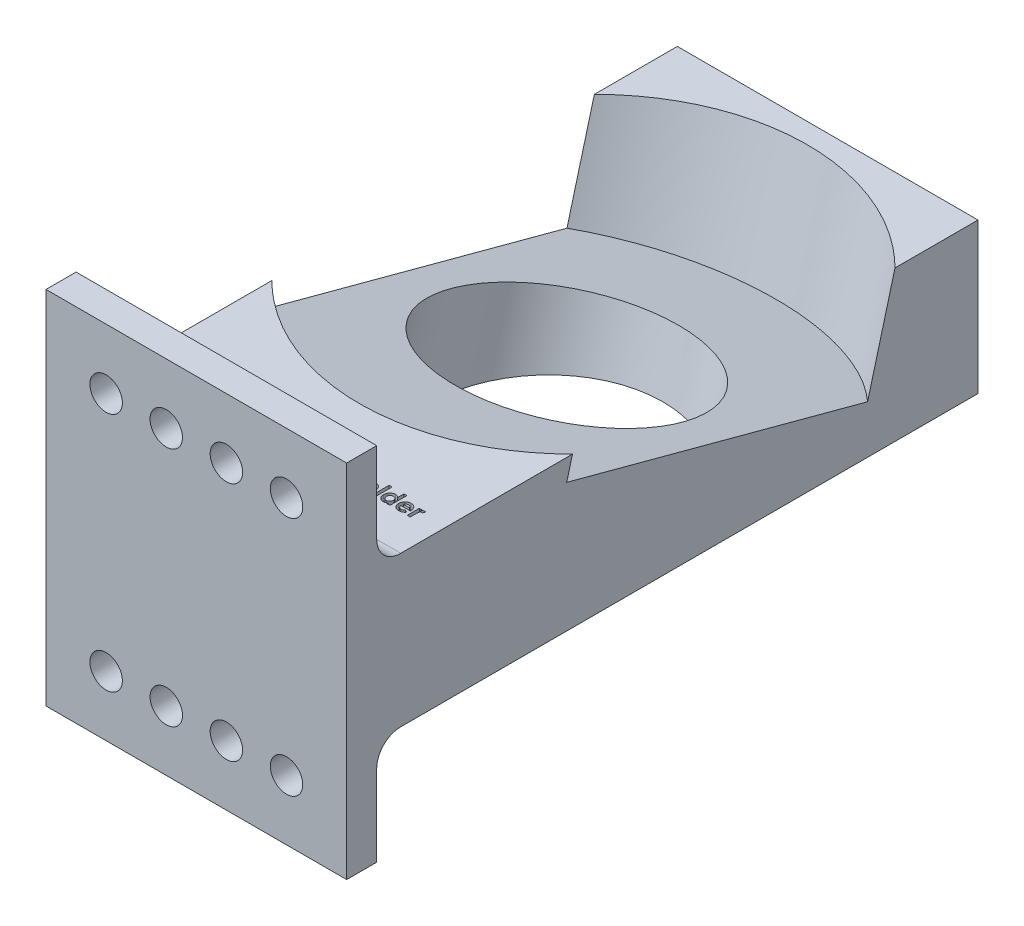
from build123d import *

# Parameters (mm, degrees)
SKETCH1_W           = 127
SKETCH1_H           = 31.75
BOSS_EXTRUDE1_DEPTH = 31.75
SKETCH3_W           = 63.5
SKETCH3_H           = 76.2
SKETCH3_R           = 3.429
BOSS_EXTRUDE2_DEPTH = 6.35
FILLET1_R           = 5.08
SKETCH4_W           = 0.628205128
SKETCH4_H           = 2.557692308
SKETCH4_W_2         = 0.628205129
SKETCH4_H_2         = 3.58974359
CUT_EXTRUDE1_DEPTH  = 2.54


with BuildPart() as part:
    # Sketch1 → Boss-Extrude1 (new, symmetric)
    with BuildSketch(Plane(origin=(0, 0, 0), x_dir=(0, 0, -1), z_dir=(1, 0, 0))):
        Rectangle(SKETCH1_W, SKETCH1_H)
    extrude(amount=BOSS_EXTRUDE1_DEPTH, both=True)

    # Sketch2 → Cut-Revolve1 (revolve, cut)
    with BuildSketch(Plane(origin=(0, 0, 0), x_dir=(0, 0, -1), z_dir=(1, 0, 0))):
        Polygon((32.022094038, -3.524804639), (23.614471638, -34.902478605), (0, -28.575), (16.956034482, 34.705782183), (61.11816326, 22.872575441), (52.569751177, -9.030532776), align=None)
    revolve(axis=Axis((0, -28.575, 0), (0, 0.9659258262890701, -0.2588190451025143)), mode=Mode.SUBTRACT)

    # Sketch3 → Boss-Extrude2 (add)
    with BuildSketch(Plane.XY.offset(63.5)):
        Rectangle(SKETCH3_W, SKETCH3_H)
        with Locations((-19.05, 25.4)):
            Circle(SKETCH3_R, mode=Mode.SUBTRACT)
        with Locations((-6.35, 25.4)):
            Circle(SKETCH3_R, mode=Mode.SUBTRACT)
        with Locations((6.35, 25.4)):
            Circle(SKETCH3_R, mode=Mode.SUBTRACT)
        with Locations((19.05, 25.4)):
            Circle(SKETCH3_R, mode=Mode.SUBTRACT)
        with Locations((-6.35, -25.4)):
            Circle(SKETCH3_R, mode=Mode.SUBTRACT)
        with Locations((6.35, -25.4)):
            Circle(SKETCH3_R, mode=Mode.SUBTRACT)
        with Locations((19.05, -25.4)):
            Circle(SKETCH3_R, mode=Mode.SUBTRACT)
        with Locations((-19.05, -25.4)):
            Circle(SKETCH3_R, mode=Mode.SUBTRACT)
    extrude(amount=BOSS_EXTRUDE2_DEPTH)

    # Fillet1
    fillet1_edges = [part.edges().sort_by_distance(p)[0] for p in [
        (0, 15.875, 63.5),
        (0, -15.875, 63.5),
    ]]
    fillet(fillet1_edges, radius=FILLET1_R)

    # Sketch4 → Cut-Extrude1 (cut)
    # profile 1 of 21: a face of its own
    with BuildSketch(Plane(origin=(0, 15.875, 0), x_dir=(1, 0, 0), z_dir=(0, 1, 0))):
        with BuildLine():
            Line((-25.217948718, -48.152564103), (-25.846153846, -48.152564103))
            add(Edge.make_bspline(
                [(-25.846153846, -48.152564103), (-25.841718479, -48.121162369), (-25.833023236, -48.059601351), (-25.812216681, -47.970476333), (-25.787329796, -47.885935154), (-25.756259792, -47.806245538), (-25.719819732, -47.731265532), (-25.678380171, -47.660737841), (-25.631493131, -47.594965184), (-25.595553719, -47.555343474), (-25.577624199, -47.535576923)],
                knots=[0, 0, 0, 0, 1.111473889, 2.178970933, 3.205615836, 4.199322666, 5.174200091, 6.12565194, 7.064921805, 8, 8, 8, 8], degree=3))
            add(Edge.make_bspline(
                [(-25.577624199, -47.535576923), (-25.551763242, -47.509496391), (-25.500794014, -47.458094403), (-25.415618456, -47.392254135), (-25.326338741, -47.33527386), (-25.231164325, -47.290099486), (-25.131576195, -47.253536064), (-25.02678239, -47.228976331), (-24.917211137, -47.212680731), (-24.842442541, -47.211075557), (-24.804286859, -47.21025641)],
                knots=[0, 0, 0, 0, 1.01925491, 2.00884431, 2.983262333, 3.955970413, 4.92937149, 5.924503185, 6.940838805, 8, 8, 8, 8], degree=3))
            add(Edge.make_bspline(
                [(-24.804286859, -47.21025641), (-24.770364495, -47.211057251), (-24.703679962, -47.212631542), (-24.605670479, -47.225269097), (-24.512226638, -47.247433961), (-24.422360712, -47.276414024), (-24.337394335, -47.315846242), (-24.255452217, -47.361618655), (-24.178823824, -47.417760421), (-24.10732986, -47.481194967), (-24.041649018, -47.549805638), (-23.984769121, -47.623144803), (-23.935868453, -47.699253404), (-23.895580771, -47.778763759), (-23.864605018, -47.86181041), (-23.843106927, -47.947913606), (-23.829035904, -48.036883356), (-23.827634063, -48.097354896), (-23.826923077, -48.12802484)],
                knots=[0, 0, 0, 0, 1.091422571, 2.145516843, 3.172569842, 4.178562979, 5.178154469, 6.181868002, 7.194278174, 8.227918432, 9.254613415, 10.245994977, 11.209837596, 12.161663635, 13.10878368, 14.055455738, 15.013766427, 16, 16, 16, 16], degree=3))
            add(Edge.make_bspline(
                [(-23.826923077, -48.12802484), (-23.828382062, -48.166007011), (-23.831254355, -48.240782229), (-23.854823601, -48.350221317), (-23.891715879, -48.454864614), (-23.945010363, -48.553248005), (-24.011642042, -48.645103745), (-24.09339688, -48.727360821), (-24.187946288, -48.801308911), (-24.258925788, -48.841048624), (-24.295272436, -48.861398237)],
                knots=[0, 0, 0, 0, 0.992805628, 1.954529043, 2.915727527, 3.886831945, 4.871318353, 5.87440735, 6.911542536, 8, 8, 8, 8], degree=3))
            add(Edge.make_bspline(
                [(-24.295272436, -48.861398237), (-24.270324655, -48.869589119), (-24.221303384, -48.885683834), (-24.151625541, -48.917382195), (-24.085369874, -48.952023248), (-24.023677283, -48.99226702), (-23.965934159, -49.036486232), (-23.912492512, -49.085058884), (-23.863033039, -49.137879066), (-23.818363148, -49.19523727), (-23.778716874, -49.256216161), (-23.743144383, -49.319407164), (-23.71386624, -49.385768582), (-23.689064009, -49.454542523), (-23.670181001, -49.52634709), (-23.656885677, -49.600904047), (-23.649200653, -49.678043325), (-23.648028556, -49.730305139), (-23.647435897, -49.756730769)],
                knots=[0, 0, 0, 0, 1.059543567, 2.081955587, 3.086750234, 4.076226789, 5.052108497, 6.020845489, 6.989030705, 7.970690546, 8.952259656, 9.923888338, 10.895517021, 11.877585046, 12.873342345, 13.889638361, 14.932918083, 16, 16, 16, 16], degree=3))
            add(Edge.make_bspline(
                [(-23.647435897, -49.756730769), (-23.648637296, -49.795565717), (-23.651006209, -49.872140324), (-23.666066648, -49.984926884), (-23.694106474, -50.092458848), (-23.730994417, -50.195973534), (-23.78019893, -50.294134606), (-23.838104369, -50.389194724), (-23.909281788, -50.477857232), (-23.988383269, -50.562466136), (-24.076230074, -50.639388762), (-24.171470302, -50.706077218), (-24.272009702, -50.763307779), (-24.378484358, -50.809769178), (-24.490857279, -50.84554977), (-24.608877995, -50.871413631), (-24.733042396, -50.887237569), (-24.817794315, -50.888896408), (-24.861077724, -50.88974359)],
                knots=[0, 0, 0, 0, 1.005138573, 1.981928558, 2.936866704, 3.876260664, 4.820238198, 5.773547, 6.751179199, 7.756627054, 8.768222608, 9.766606018, 10.760583154, 11.757261445, 12.767156078, 13.807575856, 14.880313354, 16, 16, 16, 16], degree=3))
            add(Edge.make_bspline(
                [(-24.861077724, -50.88974359), (-24.902023131, -50.88885038), (-24.982086457, -50.887103827), (-25.099195827, -50.871986526), (-25.210497198, -50.847601092), (-25.316274612, -50.813227802), (-25.416118827, -50.768651518), (-25.510935267, -50.715571165), (-25.598831892, -50.650925194), (-25.680788043, -50.577631843), (-25.754985685, -50.495400866), (-25.821300904, -50.406137101), (-25.878271438, -50.309501116), (-25.926130923, -50.205905778), (-25.964505207, -50.095169352), (-25.994774729, -49.977517024), (-26.015918486, -49.85271894), (-26.022357861, -49.766855203), (-26.025641026, -49.723076923)],
                knots=[0, 0, 0, 0, 1.066544725, 2.085487077, 3.070979577, 4.031932826, 4.977951092, 5.916076795, 6.857635327, 7.814973522, 8.776389752, 9.738577119, 10.707772778, 11.69409279, 12.707140348, 13.757286496, 14.856535458, 16, 16, 16, 16], degree=3))
            Line((-26.025641026, -49.723076923), (-25.397435897, -49.723076923))
            add(Edge.make_bspline(
                [(-25.397435897, -49.723076923), (-25.393455027, -49.745089217), (-25.385701238, -49.787963931), (-25.370577948, -49.850036987), (-25.350870191, -49.907334251), (-25.328083121, -49.96036498), (-25.303469655, -50.009825449), (-25.273730701, -50.053888962), (-25.241045375, -50.093752021), (-25.193880212, -50.141141666), (-25.126454362, -50.189832548), (-25.035407127, -50.232147241), (-24.934125699, -50.256948849), (-24.863319881, -50.25997457), (-24.826722756, -50.261538462)],
                knots=[0, 0, 0, 0, 0.928156231, 1.807827665, 2.648129825, 3.438902246, 4.202261636, 4.936546065, 5.639352463, 6.338805438, 7.70633318, 9.064371875, 10.482673459, 12, 12, 12, 12], degree=3))
            add(Edge.make_bspline(
                [(-24.826722756, -50.261538462), (-24.807303029, -50.261205445), (-24.769264126, -50.260553141), (-24.713390643, -50.253323225), (-24.660163283, -50.241415548), (-24.609482908, -50.225233455), (-24.561026883, -50.20494819), (-24.515721009, -50.178791555), (-24.47264184, -50.148380733), (-24.432257684, -50.114190896), (-24.394941892, -50.076936213), (-24.363892959, -50.03568298), (-24.33551648, -49.993762322), (-24.314529032, -49.948431642), (-24.296139506, -49.902130215), (-24.284884177, -49.853177444), (-24.276385595, -49.802600226), (-24.275891692, -49.767987398), (-24.275641026, -49.750420673)],
                knots=[0, 0, 0, 0, 1.110435564, 2.175094844, 3.216326037, 4.226890168, 5.215276772, 6.21526065, 7.213097102, 8.228249917, 9.239874822, 10.221364777, 11.178138315, 12.128914389, 13.072518965, 14.022636769, 14.996447288, 16, 16, 16, 16], degree=3))
            add(Edge.make_bspline(
                [(-24.275641026, -49.750420673), (-24.276306498, -49.731208466), (-24.2776313, -49.692961364), (-24.288455071, -49.63714776), (-24.305548094, -49.583459572), (-24.329292391, -49.532134556), (-24.361000253, -49.483361885), (-24.398415176, -49.436163032), (-24.444484839, -49.392994614), (-24.495029428, -49.350323941), (-24.553641295, -49.313127983), (-24.61746596, -49.278801579), (-24.688180833, -49.251488359), (-24.764059703, -49.227092595), (-24.846537887, -49.209274308), (-24.935103229, -49.196336494), (-25.029612857, -49.186706297), (-25.094759573, -49.185324687), (-25.128205128, -49.184615385)],
                knots=[0, 0, 0, 0, 0.809814727, 1.612155564, 2.388397, 3.182215007, 3.988903953, 4.837162975, 5.715530372, 6.646997145, 7.623086902, 8.637258368, 9.698941581, 10.815059213, 11.996518529, 13.252603015, 14.589518788, 16, 16, 16, 16], degree=3))
            Line((-25.128205128, -49.184615385), (-25.128205128, -48.601282051))
            add(Edge.make_bspline(
                [(-25.128205128, -48.601282051), (-25.086563423, -48.59773571), (-25.008660038, -48.591101209), (-24.900525963, -48.575586197), (-24.809491011, -48.554847828), (-24.733367156, -48.529828109), (-24.670158784, -48.497696271), (-24.614940299, -48.462224142), (-24.567383527, -48.421028447), (-24.527191676, -48.375337637), (-24.495039446, -48.326269992), (-24.47228397, -48.274588168), (-24.457257443, -48.221891265), (-24.455833681, -48.185848172), (-24.455128205, -48.167988782)],
                knots=[0, 0, 0, 0, 1.70044513, 3.18119609, 4.440695891, 5.496282586, 6.431922213, 7.318171381, 8.16090191, 8.983045123, 9.787564368, 10.536848927, 11.275007137, 12, 12, 12, 12], degree=3))
            add(Edge.make_bspline(
                [(-24.455128205, -48.167988782), (-24.456345353, -48.14520214), (-24.458720967, -48.100727438), (-24.477171274, -48.037074771), (-24.509198917, -47.980333694), (-24.552142362, -47.930623606), (-24.604470443, -47.889102015), (-24.665808127, -47.858958048), (-24.734824384, -47.841247122), (-24.783381038, -47.839411095), (-24.80849359, -47.838461538)],
                knots=[0, 0, 0, 0, 1.009664648, 1.970651636, 2.907870547, 3.878035693, 4.867062054, 5.849714035, 6.887914197, 8, 8, 8, 8], degree=3))
            add(Edge.make_bspline(
                [(-24.80849359, -47.838461538), (-24.831255294, -47.839581916), (-24.876421487, -47.841805087), (-24.942467979, -47.858398251), (-25.005190143, -47.886330778), (-25.063289179, -47.924848086), (-25.115926415, -47.97110574), (-25.159126399, -48.02588833), (-25.195058098, -48.085913735), (-25.210288599, -48.130260218), (-25.217948718, -48.152564103)],
                knots=[0, 0, 0, 0, 0.98818071, 1.960853194, 2.938124878, 3.957524365, 4.978590984, 5.968022688, 6.978025184, 8, 8, 8, 8], degree=3))
        make_face()
    # profile 2 of 21: a face of its own
    with BuildSketch(Plane(origin=(0, 15.875, 0), x_dir=(1, 0, 0), z_dir=(0, 1, 0))):
        with BuildLine():
            add(Edge.make_bspline(
                [(-22.154747596, -47.21025641), (-22.124339861, -47.210707822), (-22.064550128, -47.211595417), (-21.976491107, -47.221208799), (-21.891665922, -47.235731937), (-21.809742728, -47.255986651), (-21.731311216, -47.282793043), (-21.655800545, -47.314879835), (-21.58410951, -47.353930044), (-21.515323822, -47.398039262), (-21.449469978, -47.447977149), (-21.388130727, -47.50490892), (-21.330185886, -47.56752457), (-21.276889746, -47.636770737), (-21.227062048, -47.712017553), (-21.180866519, -47.79327695), (-21.138656795, -47.880946639), (-21.099959807, -47.975184826), (-21.065356838, -48.077404101), (-21.0362108, -48.188776963), (-21.011213196, -48.309328847), (-20.990113454, -48.439359824), (-20.974165459, -48.579042736), (-20.96341619, -48.728284786), (-20.956039532, -48.886798256), (-20.955437501, -48.995537194), (-20.955128205, -49.051402244)],
                knots=[0, 0, 0, 0, 0.879237366, 1.728815576, 2.559023295, 3.367336655, 4.166867292, 4.954216142, 5.737608147, 6.525189134, 7.316157332, 8.124696809, 8.942788509, 9.781158001, 10.649253743, 11.551476218, 12.482711956, 13.461909668, 14.496590415, 15.601789533, 16.789733467, 18.056700938, 19.410929216, 20.8549011, 22.384193279, 24, 24, 24, 24], degree=3))
            add(Edge.make_bspline(
                [(-20.955128205, -49.051402244), (-20.95546247, -49.107966228), (-20.956111942, -49.217869035), (-20.96310954, -49.37783235), (-20.975159735, -49.528157986), (-20.990690895, -49.668830392), (-21.011964336, -49.799775281), (-21.036878493, -49.921331711), (-21.066484592, -50.033455622), (-21.102227372, -50.135894375), (-21.140690126, -50.230298065), (-21.183015312, -50.317796819), (-21.228465206, -50.398627631), (-21.275997326, -50.474009945), (-21.328217558, -50.541721529), (-21.382584195, -50.604064929), (-21.441464457, -50.658665407), (-21.502379259, -50.708336825), (-21.567560155, -50.751262898), (-21.636334953, -50.788805334), (-21.709929787, -50.819256709), (-21.787003149, -50.845741688), (-21.86886877, -50.864755045), (-21.954225816, -50.87984152), (-22.044037952, -50.888179231), (-22.105185671, -50.889213579), (-22.136518429, -50.88974359)],
                knots=[0, 0, 0, 0, 1.643780988, 3.193836972, 4.651895693, 6.025988579, 7.305620092, 8.505800249, 9.631074763, 10.672816429, 11.65661981, 12.592235626, 13.49536222, 14.350718032, 15.179365177, 15.97804903, 16.751647189, 17.51006938, 18.259804725, 19.016521909, 19.783502495, 20.571750527, 21.382245291, 22.22305063, 23.089471752, 24, 24, 24, 24], degree=3))
            add(Edge.make_bspline(
                [(-22.136518429, -50.88974359), (-22.167850342, -50.889203355), (-22.229229099, -50.888145043), (-22.319284096, -50.879903514), (-22.405093491, -50.86469393), (-22.487606801, -50.845595718), (-22.566249744, -50.81931531), (-22.641399413, -50.787952852), (-22.71247797, -50.750644662), (-22.77968222, -50.707618575), (-22.842782711, -50.658279496), (-22.902760023, -50.603155162), (-22.959481482, -50.542385299), (-23.012084214, -50.475289235), (-23.061429701, -50.402762561), (-23.107003346, -50.323977059), (-23.148777762, -50.239047439), (-23.188059659, -50.147855316), (-23.222190655, -50.04843743), (-23.252565657, -49.939905991), (-23.277448059, -49.8213563), (-23.297460152, -49.692826443), (-23.313437796, -49.554588715), (-23.325323327, -49.406576394), (-23.332359793, -49.248720538), (-23.333002454, -49.140218345), (-23.333333333, -49.084354968)],
                knots=[0, 0, 0, 0, 0.917216111, 1.796812873, 2.643793957, 3.46689424, 4.273913431, 5.068098542, 5.848489301, 6.620921603, 7.401012384, 8.190319798, 9.003608147, 9.831726257, 10.68377682, 11.569763213, 12.493818149, 13.453288342, 14.474581811, 15.568529029, 16.750744269, 18.018426408, 19.375425659, 20.823733699, 22.36466933, 24, 24, 24, 24], degree=3))
            add(Edge.make_bspline(
                [(-23.333333333, -49.084354968), (-23.332733975, -49.006737203), (-23.331577507, -48.856972725), (-23.316921886, -48.640606598), (-23.295411153, -48.440613594), (-23.263816981, -48.257328251), (-23.224751224, -48.090071735), (-23.174725488, -47.939945844), (-23.117774827, -47.804873248), (-23.069245547, -47.724855429), (-23.045873397, -47.686318109)],
                knots=[0, 0, 0, 0, 1.288568992, 2.486310467, 3.599230591, 4.627010532, 5.572937695, 6.447898582, 7.252493626, 8, 8, 8, 8], degree=3))
            add(Edge.make_bspline(
                [(-23.045873397, -47.686318109), (-23.018697375, -47.648459058), (-22.965562898, -47.574437152), (-22.872655778, -47.477260226), (-22.772839174, -47.394149761), (-22.66406291, -47.32698662), (-22.548047327, -47.274021762), (-22.423796374, -47.236613279), (-22.291768887, -47.214817353), (-22.20110341, -47.211799428), (-22.154747596, -47.21025641)],
                knots=[0, 0, 0, 0, 1.058512271, 2.069600068, 3.047294572, 4.004278952, 4.967380941, 5.939006123, 6.946246673, 8, 8, 8, 8], degree=3))
        make_face()
        with BuildLine():
            add(Edge.make_bspline(
                [(-22.139322917, -47.838461538), (-22.166811762, -47.839764455), (-22.22070449, -47.842318863), (-22.298905407, -47.864002185), (-22.372643989, -47.897493244), (-22.428734958, -47.937794497), (-22.470718491, -47.976428082), (-22.500052687, -48.011390219), (-22.528340895, -48.050405445), (-22.553326465, -48.095234315), (-22.576919365, -48.144266076), (-22.59997674, -48.197723302), (-22.618877733, -48.256919019), (-22.637447458, -48.320845115), (-22.653716269, -48.391268978), (-22.667345966, -48.468766244), (-22.679522903, -48.553840886), (-22.688016461, -48.646548628), (-22.695935007, -48.746792474), (-22.701611395, -48.854795729), (-22.70398455, -48.970529256), (-22.704738904, -49.050233219), (-22.705128205, -49.091366186)],
                knots=[0, 0, 0, 0, 1.076674018, 2.110852608, 3.161083442, 4.239746716, 4.804137807, 5.395870207, 6.026861976, 6.692161227, 7.405688833, 8.16177676, 8.973626916, 9.841385931, 10.773283133, 11.807421078, 12.927755683, 14.143907515, 15.458935494, 16.872852025, 18.386167141, 20, 20, 20, 20], degree=3))
            add(Edge.make_bspline(
                [(-22.705128205, -49.091366186), (-22.704487463, -49.144655933), (-22.703258793, -49.246842974), (-22.696823594, -49.393791497), (-22.683924772, -49.527526485), (-22.667881241, -49.648954311), (-22.645347446, -49.757287482), (-22.619420857, -49.85355093), (-22.587403825, -49.93651753), (-22.550401975, -50.007387166), (-22.509420759, -50.067675819), (-22.464933846, -50.118921445), (-22.418455856, -50.163297739), (-22.368536061, -50.199344056), (-22.315293553, -50.226968292), (-22.25917281, -50.246838064), (-22.200138168, -50.259001178), (-22.159711854, -50.260687811), (-22.139322917, -50.261538462)],
                knots=[0, 0, 0, 0, 1.771748488, 3.397459088, 4.888034009, 6.237357457, 7.467047327, 8.564189669, 9.548206622, 10.417051504, 11.216568818, 11.965764335, 12.669334354, 13.348544111, 14.005342236, 14.656555988, 15.322436492, 16, 16, 16, 16], degree=3))
            add(Edge.make_bspline(
                [(-22.139322917, -50.261538462), (-22.119633663, -50.260956383), (-22.081084553, -50.259816747), (-22.024871318, -50.248118531), (-21.971712088, -50.229099773), (-21.921767368, -50.202196405), (-21.874858513, -50.167984656), (-21.831214784, -50.126314185), (-21.791165334, -50.076769634), (-21.767832342, -50.040000251), (-21.755809295, -50.021053686)],
                knots=[0, 0, 0, 0, 0.992283464, 1.942767638, 2.88273346, 3.832339453, 4.79467288, 5.803907806, 6.868395428, 8, 8, 8, 8], degree=3))
            add(Edge.make_bspline(
                [(-21.755809295, -50.021053686), (-21.741654182, -49.995163811), (-21.711972057, -49.940874842), (-21.677623852, -49.849264233), (-21.648711447, -49.745942606), (-21.623826963, -49.630588415), (-21.606807494, -49.50274669), (-21.592150348, -49.363228085), (-21.585080842, -49.211330042), (-21.583930948, -49.10609453), (-21.583333333, -49.051402244)],
                knots=[0, 0, 0, 0, 0.710965849, 1.490837728, 2.352621235, 3.297892224, 4.334225155, 5.461620853, 6.680770821, 8, 8, 8, 8], degree=3))
            add(Edge.make_bspline(
                [(-21.583333333, -49.051402244), (-21.583564179, -48.996235202), (-21.584008518, -48.890048065), (-21.592160845, -48.737603937), (-21.603513583, -48.598371527), (-21.620119361, -48.472661684), (-21.641485714, -48.360169239), (-21.667819824, -48.260901546), (-21.698865781, -48.174662967), (-21.735682585, -48.101539495), (-21.776459484, -48.039394574), (-21.819745407, -47.986079053), (-21.865723385, -47.940559606), (-21.914316527, -47.902664936), (-21.966649538, -47.873710565), (-22.021722791, -47.853266384), (-22.079649189, -47.840898341), (-22.119163193, -47.839284769), (-22.139322917, -47.838461538)],
                knots=[0, 0, 0, 0, 1.793836731, 3.452829483, 4.963243077, 6.335886805, 7.574563692, 8.684454726, 9.672768357, 10.54971625, 11.340229787, 12.085688095, 12.778991901, 13.440269426, 14.083255152, 14.715733572, 15.344777694, 16, 16, 16, 16], degree=3))
        make_face(mode=Mode.SUBTRACT)
    # profile 3 of 21: a face of its own
    with BuildSketch(Plane(origin=(0, 15.875, 0), x_dir=(1, 0, 0), z_dir=(0, 1, 0))):
        with BuildLine():
            add(Edge.make_bspline(
                [(-19.462439904, -47.21025641), (-19.432032168, -47.210707822), (-19.372242436, -47.211595417), (-19.284183414, -47.221208799), (-19.19935823, -47.235731937), (-19.117435036, -47.255986651), (-19.039003524, -47.282793043), (-18.963492852, -47.314879835), (-18.891801818, -47.353930044), (-18.82301613, -47.398039262), (-18.757162285, -47.447977149), (-18.695823035, -47.50490892), (-18.637878193, -47.56752457), (-18.584582053, -47.636770737), (-18.534754356, -47.712017553), (-18.488558826, -47.79327695), (-18.446349103, -47.880946639), (-18.407652115, -47.975184826), (-18.373049146, -48.077404101), (-18.343903108, -48.188776963), (-18.318905504, -48.309328847), (-18.297805762, -48.439359824), (-18.281857767, -48.579042736), (-18.271108498, -48.728284786), (-18.26373184, -48.886798256), (-18.263129809, -48.995537194), (-18.262820513, -49.051402244)],
                knots=[0, 0, 0, 0, 0.879237366, 1.728815576, 2.559023295, 3.367336655, 4.166867292, 4.954216142, 5.737608147, 6.525189134, 7.316157332, 8.124696809, 8.942788509, 9.781158001, 10.649253743, 11.551476218, 12.482711956, 13.461909668, 14.496590415, 15.601789533, 16.789733467, 18.056700938, 19.410929216, 20.8549011, 22.384193279, 24, 24, 24, 24], degree=3))
            add(Edge.make_bspline(
                [(-18.262820513, -49.051402244), (-18.263154778, -49.107966228), (-18.26380425, -49.217869035), (-18.270801848, -49.37783235), (-18.282852042, -49.528157986), (-18.298383203, -49.668830392), (-18.319656644, -49.799775281), (-18.344570801, -49.921331711), (-18.3741769, -50.033455622), (-18.40991968, -50.135894375), (-18.448382434, -50.230298065), (-18.490707619, -50.317796819), (-18.536157514, -50.398627631), (-18.583689634, -50.474009945), (-18.635909866, -50.541721529), (-18.690276502, -50.604064929), (-18.749156765, -50.658665407), (-18.810071566, -50.708336825), (-18.875252463, -50.751262898), (-18.944027261, -50.788805334), (-19.017622095, -50.819256709), (-19.094695457, -50.845741688), (-19.176561077, -50.864755045), (-19.261918124, -50.87984152), (-19.351730259, -50.888179231), (-19.412877979, -50.889213579), (-19.444210737, -50.88974359)],
                knots=[0, 0, 0, 0, 1.643780988, 3.193836972, 4.651895693, 6.025988579, 7.305620092, 8.505800249, 9.631074763, 10.672816429, 11.65661981, 12.592235626, 13.49536222, 14.350718032, 15.179365177, 15.97804903, 16.751647189, 17.51006938, 18.259804725, 19.016521909, 19.783502495, 20.571750527, 21.382245291, 22.22305063, 23.089471752, 24, 24, 24, 24], degree=3))
            add(Edge.make_bspline(
                [(-19.444210737, -50.88974359), (-19.47554265, -50.889203355), (-19.536921407, -50.888145043), (-19.626976403, -50.879903514), (-19.712785799, -50.86469393), (-19.795299108, -50.845595718), (-19.873942052, -50.81931531), (-19.94909172, -50.787952852), (-20.020170277, -50.750644662), (-20.087374528, -50.707618575), (-20.150475019, -50.658279496), (-20.21045233, -50.603155162), (-20.267173789, -50.542385299), (-20.319776522, -50.475289235), (-20.369122009, -50.402762561), (-20.414695654, -50.323977059), (-20.456470069, -50.239047439), (-20.495751966, -50.147855316), (-20.529882963, -50.04843743), (-20.560257964, -49.939905991), (-20.585140367, -49.8213563), (-20.60515246, -49.692826443), (-20.621130104, -49.554588715), (-20.633015634, -49.406576394), (-20.640052101, -49.248720538), (-20.640694761, -49.140218345), (-20.641025641, -49.084354968)],
                knots=[0, 0, 0, 0, 0.917216111, 1.796812873, 2.643793957, 3.46689424, 4.273913431, 5.068098542, 5.848489301, 6.620921603, 7.401012384, 8.190319798, 9.003608147, 9.831726257, 10.68377682, 11.569763213, 12.493818149, 13.453288342, 14.474581811, 15.568529029, 16.750744269, 18.018426408, 19.375425659, 20.823733699, 22.36466933, 24, 24, 24, 24], degree=3))
            add(Edge.make_bspline(
                [(-20.641025641, -49.084354968), (-20.640426283, -49.006737203), (-20.639269815, -48.856972725), (-20.624614194, -48.640606598), (-20.603103461, -48.440613594), (-20.571509288, -48.257328251), (-20.532443532, -48.090071735), (-20.482417796, -47.939945844), (-20.425467134, -47.804873248), (-20.376937854, -47.724855429), (-20.353565705, -47.686318109)],
                knots=[0, 0, 0, 0, 1.288568992, 2.486310467, 3.599230591, 4.627010532, 5.572937695, 6.447898582, 7.252493626, 8, 8, 8, 8], degree=3))
            add(Edge.make_bspline(
                [(-20.353565705, -47.686318109), (-20.326389683, -47.648459058), (-20.273255205, -47.574437152), (-20.180348086, -47.477260226), (-20.080531482, -47.394149761), (-19.971755218, -47.32698662), (-19.855739635, -47.274021762), (-19.731488682, -47.236613279), (-19.599461195, -47.214817353), (-19.508795718, -47.211799428), (-19.462439904, -47.21025641)],
                knots=[0, 0, 0, 0, 1.058512271, 2.069600068, 3.047294572, 4.004278952, 4.967380941, 5.939006123, 6.946246673, 8, 8, 8, 8], degree=3))
        make_face()
        with BuildLine():
            add(Edge.make_bspline(
                [(-19.447015224, -47.838461538), (-19.474504069, -47.839764455), (-19.528396798, -47.842318863), (-19.606597714, -47.864002185), (-19.680336296, -47.897493244), (-19.736427266, -47.937794497), (-19.778410799, -47.976428082), (-19.807744994, -48.011390219), (-19.836033203, -48.050405445), (-19.861018773, -48.095234315), (-19.884611673, -48.144266076), (-19.907669048, -48.197723302), (-19.926570041, -48.256919019), (-19.945139765, -48.320845115), (-19.961408577, -48.391268978), (-19.975038274, -48.468766244), (-19.987215211, -48.553840886), (-19.995708769, -48.646548628), (-20.003627314, -48.746792474), (-20.009303703, -48.854795729), (-20.011676858, -48.970529256), (-20.012431212, -49.050233219), (-20.012820513, -49.091366186)],
                knots=[0, 0, 0, 0, 1.076674018, 2.110852608, 3.161083442, 4.239746716, 4.804137807, 5.395870207, 6.026861976, 6.692161227, 7.405688833, 8.16177676, 8.973626916, 9.841385931, 10.773283133, 11.807421078, 12.927755683, 14.143907515, 15.458935494, 16.872852025, 18.386167141, 20, 20, 20, 20], degree=3))
            add(Edge.make_bspline(
                [(-20.012820513, -49.091366186), (-20.012179771, -49.144655933), (-20.010951101, -49.246842974), (-20.004515902, -49.393791497), (-19.991617079, -49.527526485), (-19.975573548, -49.648954311), (-19.953039754, -49.757287482), (-19.927113165, -49.85355093), (-19.895096132, -49.93651753), (-19.858094282, -50.007387166), (-19.817113066, -50.067675819), (-19.772626154, -50.118921445), (-19.726148164, -50.163297739), (-19.676228369, -50.199344056), (-19.622985861, -50.226968292), (-19.566865118, -50.246838064), (-19.507830476, -50.259001178), (-19.467404161, -50.260687811), (-19.447015224, -50.261538462)],
                knots=[0, 0, 0, 0, 1.771748488, 3.397459088, 4.888034009, 6.237357457, 7.467047327, 8.564189669, 9.548206622, 10.417051504, 11.216568818, 11.965764335, 12.669334354, 13.348544111, 14.005342236, 14.656555988, 15.322436492, 16, 16, 16, 16], degree=3))
            add(Edge.make_bspline(
                [(-19.447015224, -50.261538462), (-19.427325971, -50.260956383), (-19.388776861, -50.259816747), (-19.332563626, -50.248118531), (-19.279404396, -50.229099773), (-19.229459676, -50.202196405), (-19.182550821, -50.167984656), (-19.138907092, -50.126314185), (-19.098857641, -50.076769634), (-19.07552465, -50.040000251), (-19.063501603, -50.021053686)],
                knots=[0, 0, 0, 0, 0.992283464, 1.942767638, 2.88273346, 3.832339453, 4.79467288, 5.803907806, 6.868395428, 8, 8, 8, 8], degree=3))
            add(Edge.make_bspline(
                [(-19.063501603, -50.021053686), (-19.049346489, -49.995163811), (-19.019664365, -49.940874842), (-18.98531616, -49.849264233), (-18.956403755, -49.745942606), (-18.931519271, -49.630588415), (-18.914499801, -49.50274669), (-18.899842655, -49.363228085), (-18.89277315, -49.211330042), (-18.891623256, -49.10609453), (-18.891025641, -49.051402244)],
                knots=[0, 0, 0, 0, 0.710965849, 1.490837728, 2.352621235, 3.297892224, 4.334225155, 5.461620853, 6.680770821, 8, 8, 8, 8], degree=3))
            add(Edge.make_bspline(
                [(-18.891025641, -49.051402244), (-18.891256487, -48.996235202), (-18.891700825, -48.890048065), (-18.899853152, -48.737603937), (-18.91120589, -48.598371527), (-18.927811669, -48.472661684), (-18.949178021, -48.360169239), (-18.975512131, -48.260901546), (-19.006558088, -48.174662967), (-19.043374893, -48.101539495), (-19.084151792, -48.039394574), (-19.127437715, -47.986079053), (-19.173415692, -47.940559606), (-19.222008834, -47.902664936), (-19.274341846, -47.873710565), (-19.329415098, -47.853266384), (-19.387341496, -47.840898341), (-19.4268555, -47.839284769), (-19.447015224, -47.838461538)],
                knots=[0, 0, 0, 0, 1.793836731, 3.452829483, 4.963243077, 6.335886805, 7.574563692, 8.684454726, 9.672768357, 10.54971625, 11.340229787, 12.085688095, 12.778991901, 13.440269426, 14.083255152, 14.715733572, 15.344777694, 16, 16, 16, 16], degree=3))
        make_face(mode=Mode.SUBTRACT)
    # profile 4 of 21: a face of its own
    with BuildSketch(Plane(origin=(0, 15.875, 0), x_dir=(1, 0, 0), z_dir=(0, 1, 0))):
        Polygon((-16.423076923, -47.21025641), (-15.794871795, -47.21025641), (-15.794871795, -49.30380609), (-14.817508013, -48.242307692), (-14.041366186, -48.242307692), (-15.163862179, -49.461558494), (-13.880809295, -50.8), (-14.671674679, -50.8), (-15.794871795, -49.628425481), (-15.794871795, -50.8), (-16.423076923, -50.8), align=None)
    # profile 5 of 21: a face of its own
    with BuildSketch(Plane(origin=(0, 15.875, 0), x_dir=(1, 0, 0), z_dir=(0, 1, 0))):
        Polygon((-13.506410256, -47.3), (-12.878205128, -47.3), (-12.878205128, -48.646153846), (-11.666666667, -48.646153846), (-11.666666667, -47.3), (-11.038461538, -47.3), (-11.038461538, -50.8), (-11.666666667, -50.8), (-11.666666667, -49.274358974), (-12.878205128, -49.274358974), (-12.878205128, -50.8), (-13.506410256, -50.8), align=None)
    # profile 6 of 21: a face of its own
    with BuildSketch(Plane(origin=(0, 15.875, 0), x_dir=(1, 0, 0), z_dir=(0, 1, 0))):
        Polygon((-10.41025641, -48.242307692), (-8.435897436, -48.242307692), (-9.612379808, -50.261538462), (-8.525641026, -50.261538462), (-8.525641026, -50.8), (-10.58974359, -50.8), (-9.413261218, -48.780769231), (-10.41025641, -48.780769231), align=None)
    # profile 7 of 21: a face of its own
    with BuildSketch(Plane(origin=(0, 15.875, 0), x_dir=(1, 0, 0), z_dir=(0, 1, 0))):
        with BuildLine():
            Line((-4.846153846, -47.767648237), (-5.315905449, -48.197435897))
            add(Edge.make_bspline(
                [(-5.315905449, -48.197435897), (-5.336027593, -48.169051521), (-5.374659304, -48.114557476), (-5.437277279, -48.041588666), (-5.499612501, -47.97934084), (-5.562242468, -47.928074042), (-5.62572231, -47.888099756), (-5.689941834, -47.859797519), (-5.754536961, -47.841805519), (-5.797934916, -47.839565082), (-5.819310897, -47.838461538)],
                knots=[0, 0, 0, 0, 1.299362458, 2.494594718, 3.587462134, 4.587049575, 5.512617175, 6.380583204, 7.202344345, 8, 8, 8, 8], degree=3))
            add(Edge.make_bspline(
                [(-5.819310897, -47.838461538), (-5.8392498, -47.839160794), (-5.877746582, -47.840510874), (-5.932626602, -47.853930563), (-5.981349864, -47.877090975), (-6.023868818, -47.907375163), (-6.057550103, -47.943860588), (-6.084441998, -47.982124417), (-6.099584394, -48.024359032), (-6.101577431, -48.053367468), (-6.102564103, -48.067728365)],
                knots=[0, 0, 0, 0, 1.185010067, 2.2879431, 3.333075148, 4.379039566, 5.372662701, 6.27520591, 7.14612461, 8, 8, 8, 8], degree=3))
            add(Edge.make_bspline(
                [(-6.102564103, -48.067728365), (-6.101945805, -48.082296353), (-6.100700641, -48.111634255), (-6.088674047, -48.154632605), (-6.070546536, -48.196646998), (-6.053224959, -48.222223158), (-6.044370994, -48.235296474)],
                knots=[0, 0, 0, 0, 0.967525499, 1.948461899, 2.951351359, 4, 4, 4, 4], degree=3))
            add(Edge.make_bspline(
                [(-6.044370994, -48.235296474), (-6.036321781, -48.245458226), (-6.017793557, -48.268849236), (-5.982464027, -48.30589695), (-5.938097559, -48.351283643), (-5.882986835, -48.403448599), (-5.819419654, -48.464267874), (-5.744449596, -48.531350639), (-5.660234624, -48.606774369), (-5.600376574, -48.659296724), (-5.569010417, -48.68681891)],
                knots=[0, 0, 0, 0, 0.473873513, 1.090794244, 1.870441696, 2.795289791, 3.865433203, 5.087734844, 6.473946851, 8, 8, 8, 8], degree=3))
            add(Edge.make_bspline(
                [(-5.569010417, -48.68681891), (-5.539568766, -48.712299174), (-5.48369463, -48.76065542), (-5.404196831, -48.829289347), (-5.334331505, -48.891037619), (-5.273080875, -48.944973524), (-5.22137344, -48.991662974), (-5.178991823, -49.031329145), (-5.145418403, -49.063199809), (-5.126333879, -49.082449709), (-5.118189103, -49.090665064)],
                knots=[0, 0, 0, 0, 1.543621617, 2.929473131, 4.163658386, 5.240097082, 6.164993805, 6.925417477, 7.541396219, 8, 8, 8, 8], degree=3))
            add(Edge.make_bspline(
                [(-5.118189103, -49.090665064), (-5.087289518, -49.124105032), (-5.027889665, -49.188388395), (-4.950690796, -49.288007389), (-4.88715363, -49.385255841), (-4.838000074, -49.481963637), (-4.800877331, -49.579526078), (-4.774705305, -49.680335878), (-4.759030705, -49.785446436), (-4.757290458, -49.857171561), (-4.756410256, -49.893449519)],
                knots=[0, 0, 0, 0, 1.206664779, 2.319633467, 3.337109185, 4.282041471, 5.190008762, 6.099243693, 7.03861361, 8, 8, 8, 8], degree=3))
            add(Edge.make_bspline(
                [(-4.756410256, -49.893449519), (-4.757036762, -49.928797941), (-4.758265988, -49.998152859), (-4.773321656, -50.099643451), (-4.794790154, -50.196774353), (-4.827984219, -50.288488642), (-4.868440949, -50.376291782), (-4.919159302, -50.458816077), (-4.978721054, -50.536896708), (-5.046987967, -50.609137888), (-5.122499279, -50.674691752), (-5.203492337, -50.73304935), (-5.290759133, -50.78123098), (-5.383554073, -50.820905116), (-5.481827485, -50.851462666), (-5.585462297, -50.874047543), (-5.694617025, -50.887602631), (-5.769258601, -50.889019654), (-5.807391827, -50.88974359)],
                knots=[0, 0, 0, 0, 1.043214005, 2.046824704, 3.02475056, 3.976699089, 4.921714032, 5.875962561, 6.831408892, 7.817874052, 8.806269674, 9.781291748, 10.760897367, 11.74438705, 12.757449933, 13.795994037, 14.874007457, 16, 16, 16, 16], degree=3))
            add(Edge.make_bspline(
                [(-5.807391827, -50.88974359), (-5.837326085, -50.889212536), (-5.896613082, -50.888160745), (-5.983993154, -50.879573749), (-6.068368491, -50.865715249), (-6.149644051, -50.84585188), (-6.228185997, -50.820682298), (-6.303997553, -50.789938617), (-6.376555367, -50.753144322), (-6.446408446, -50.71105605), (-6.513217217, -50.662186023), (-6.577826452, -50.607533371), (-6.63959439, -50.546257513), (-6.69881769, -50.478503364), (-6.755117425, -50.40407906), (-6.810336487, -50.324021098), (-6.862020775, -50.23684371), (-6.893948458, -50.175688067), (-6.91025641, -50.144451122)],
                knots=[0, 0, 0, 0, 1.016823716, 2.013894106, 2.979844003, 3.91962641, 4.853723003, 5.779685073, 6.695824784, 7.614987388, 8.547259901, 9.504950863, 10.487499108, 11.500346958, 12.559593716, 13.656357062, 14.802919212, 16, 16, 16, 16], degree=3))
            Line((-6.91025641, -50.144451122), (-6.357772436, -49.812820513))
            add(Edge.make_bspline(
                [(-6.357772436, -49.812820513), (-6.337373625, -49.848278527), (-6.298267362, -49.91625457), (-6.231998143, -50.007588999), (-6.164108711, -50.085801818), (-6.093029523, -50.149510612), (-6.019624876, -50.199567249), (-5.943540209, -50.235341194), (-5.864722065, -50.257485226), (-5.811034726, -50.260189524), (-5.784254808, -50.261538462)],
                knots=[0, 0, 0, 0, 1.283663364, 2.460892379, 3.537111102, 4.529833553, 5.449777664, 6.316464042, 7.160231139, 8, 8, 8, 8], degree=3))
            add(Edge.make_bspline(
                [(-5.784254808, -50.261538462), (-5.757015797, -50.260436846), (-5.704168148, -50.258299551), (-5.628734893, -50.238558004), (-5.559574828, -50.207562327), (-5.499793379, -50.16333577), (-5.449174217, -50.112291601), (-5.41181437, -50.055502629), (-5.388344662, -49.994058332), (-5.385863345, -49.951375082), (-5.384615385, -49.929907853)],
                knots=[0, 0, 0, 0, 1.13588714, 2.203786484, 3.234766741, 4.283437687, 5.291419208, 6.222934724, 7.106237994, 8, 8, 8, 8], degree=3))
            add(Edge.make_bspline(
                [(-5.384615385, -49.929907853), (-5.385767825, -49.909936089), (-5.388108897, -49.869365364), (-5.405352513, -49.80904322), (-5.432309544, -49.748748508), (-5.464201613, -49.699293155), (-5.496655786, -49.657885528), (-5.527689296, -49.622007693), (-5.565479901, -49.582368966), (-5.609931782, -49.538919484), (-5.660457614, -49.491276752), (-5.717099956, -49.439445434), (-5.780507426, -49.383882102), (-5.82532395, -49.34603291), (-5.848758013, -49.326241987)],
                knots=[0, 0, 0, 0, 0.916159276, 1.861089862, 2.860218735, 3.940849679, 4.552606315, 5.27541173, 6.11797699, 7.06649574, 8.129236253, 9.306560635, 10.591630461, 12, 12, 12, 12], degree=3))
            add(Edge.make_bspline(
                [(-5.848758013, -49.326241987), (-5.893307099, -49.288549188), (-5.97881028, -49.216205298), (-6.099637122, -49.10935565), (-6.208512926, -49.009494863), (-6.304497323, -48.91538844), (-6.388813302, -48.828774309), (-6.46088984, -48.748948955), (-6.519935142, -48.675296636), (-6.58206759, -48.588060394), (-6.641105839, -48.481757038), (-6.69213164, -48.353861777), (-6.725235025, -48.225982745), (-6.728943799, -48.140131806), (-6.730769231, -48.097876603)],
                knots=[0, 0, 0, 0, 1.345494975, 2.582412109, 3.71882943, 4.751509156, 5.681369928, 6.505683931, 7.230279997, 7.856715994, 8.973648664, 10.023341002, 11.027102913, 12, 12, 12, 12], degree=3))
            add(Edge.make_bspline(
                [(-6.730769231, -48.097876603), (-6.730010036, -48.06791148), (-6.728514342, -48.00887697), (-6.715172514, -47.922075325), (-6.695232645, -47.838319031), (-6.66627423, -47.757913669), (-6.628689705, -47.680959949), (-6.583044758, -47.607081152), (-6.528630611, -47.536957241), (-6.467309541, -47.470634703), (-6.399749422, -47.410023451), (-6.327552849, -47.356527948), (-6.251128461, -47.311344868), (-6.170943784, -47.273862222), (-6.086501946, -47.245171638), (-5.998425028, -47.224834322), (-5.906586698, -47.212738335), (-5.844120249, -47.211094026), (-5.812299679, -47.21025641)],
                knots=[0, 0, 0, 0, 1.010766082, 1.991317756, 2.957454644, 3.913069143, 4.869106762, 5.843196583, 6.838735724, 7.860187025, 8.887984031, 9.89767229, 10.887916223, 11.879572884, 12.879850636, 13.892031539, 14.926195476, 16, 16, 16, 16], degree=3))
            add(Edge.make_bspline(
                [(-5.812299679, -47.21025641), (-5.771061797, -47.21176498), (-5.688911549, -47.214770211), (-5.567450038, -47.238270136), (-5.448811513, -47.275226244), (-5.353210366, -47.319809722), (-5.277142317, -47.362997758), (-5.218843264, -47.402759861), (-5.159520839, -47.448309488), (-5.098696644, -47.499790176), (-5.037500887, -47.55817189), (-4.97419348, -47.622064808), (-4.909637063, -47.692021113), (-4.867685627, -47.741997573), (-4.846153846, -47.767648237)],
                knots=[0, 0, 0, 0, 1.282922637, 2.555718331, 3.837320111, 5.142675274, 5.830281639, 6.55870424, 7.337177975, 8.157850921, 9.037902056, 9.96903443, 10.957596896, 12, 12, 12, 12], degree=3))
        make_face()
    # profile 8 of 21: a face of its own
    with BuildSketch(Plane(origin=(0, 15.875, 0), x_dir=(1, 0, 0), z_dir=(0, 1, 0))):
        with BuildLine():
            Line((-2.288461538, -48.242307692), (-1.66025641, -48.242307692))
            Line((-1.66025641, -48.242307692), (-1.66025641, -50.8))
            Line((-1.66025641, -50.8), (-2.288461538, -50.8))
            Line((-2.288461538, -50.8), (-2.288461538, -50.520953526))
            add(Edge.make_bspline(
                [(-2.288461538, -50.520953526), (-2.319588871, -50.548115612), (-2.380000877, -50.600831856), (-2.475190649, -50.669232524), (-2.570658578, -50.725654235), (-2.666863387, -50.770591051), (-2.765283706, -50.803772264), (-2.866628121, -50.827796237), (-2.972356099, -50.841963762), (-3.044228522, -50.843892353), (-3.080729167, -50.844871795)],
                knots=[0, 0, 0, 0, 1.129196829, 2.191548051, 3.199897424, 4.157751732, 5.089409408, 6.034969131, 7.002052659, 8, 8, 8, 8], degree=3))
            add(Edge.make_bspline(
                [(-3.080729167, -50.844871795), (-3.121702763, -50.843950017), (-3.202668911, -50.842128532), (-3.321477745, -50.822954463), (-3.436199485, -50.793604276), (-3.54674101, -50.752070092), (-3.6529012, -50.698249934), (-3.755492501, -50.633548042), (-3.852756187, -50.555692995), (-3.945501944, -50.468053382), (-4.030419403, -50.371649183), (-4.104655047, -50.267818477), (-4.167230178, -50.158033872), (-4.218494634, -50.042659355), (-4.258820749, -49.921779604), (-4.287567499, -49.795011226), (-4.304528114, -49.662308945), (-4.30662736, -49.571917349), (-4.307692308, -49.526061699)],
                knots=[0, 0, 0, 0, 0.980476535, 1.937477201, 2.874147792, 3.812856188, 4.758993464, 5.720109578, 6.712210464, 7.737600662, 8.772720504, 9.783789959, 10.789002326, 11.793715968, 12.802552247, 13.835794126, 14.902098527, 16, 16, 16, 16], degree=3))
            add(Edge.make_bspline(
                [(-4.307692308, -49.526061699), (-4.306574641, -49.478578113), (-4.304382214, -49.385433768), (-4.288344741, -49.248748872), (-4.260128477, -49.118837282), (-4.221653573, -48.995519054), (-4.17216229, -48.878772881), (-4.111885214, -48.768407498), (-4.040002332, -48.66471138), (-3.957170053, -48.56944951), (-3.867731536, -48.482137405), (-3.772048135, -48.406125293), (-3.671616128, -48.341549467), (-3.566328789, -48.288830533), (-3.456201153, -48.248092009), (-3.341668003, -48.218308821), (-3.222220891, -48.200437863), (-3.140852551, -48.198444863), (-3.099659455, -48.197435897)],
                knots=[0, 0, 0, 0, 1.136281865, 2.228943489, 3.287578264, 4.313574083, 5.316051562, 6.317280042, 7.318008486, 8.329309503, 9.333984563, 10.305318864, 11.248632312, 12.186624717, 13.117503092, 14.05354244, 15.014596925, 16, 16, 16, 16], degree=3))
            add(Edge.make_bspline(
                [(-3.099659455, -48.197435897), (-3.061501301, -48.198228641), (-2.986000068, -48.199797195), (-2.875024134, -48.216828689), (-2.767393484, -48.242587613), (-2.663695249, -48.279289445), (-2.563078861, -48.325632973), (-2.467274985, -48.383704869), (-2.374187826, -48.451064395), (-2.317390023, -48.503673613), (-2.288461538, -48.53046875)],
                knots=[0, 0, 0, 0, 1.017011718, 2.012299608, 2.98747302, 3.965332399, 4.941441765, 5.936729654, 6.94912688, 8, 8, 8, 8], degree=3))
            Line((-2.288461538, -48.53046875), (-2.288461538, -48.242307692))
        make_face()
        with BuildLine():
            add(Edge.make_bspline(
                [(-2.967848558, -48.780769231), (-2.99288068, -48.781537303), (-3.041942006, -48.783042674), (-3.114093399, -48.792097584), (-3.183048487, -48.80805274), (-3.248315487, -48.831623056), (-3.310867116, -48.860335136), (-3.36975352, -48.896296543), (-3.425460704, -48.938802162), (-3.477661049, -48.986822933), (-3.525249356, -49.03960654), (-3.566273253, -49.097204891), (-3.601136938, -49.158066039), (-3.630622555, -49.222372971), (-3.651727566, -49.290886638), (-3.668442727, -49.362715114), (-3.677116813, -49.4384452), (-3.678689152, -49.490052909), (-3.679487179, -49.516245994)],
                knots=[0, 0, 0, 0, 1.04836806, 2.054732945, 3.03993516, 4.00574415, 4.955904794, 5.917688631, 6.888591924, 7.88601754, 8.884115178, 9.859153345, 10.841239365, 11.818093293, 12.814750328, 13.83810466, 14.90274714, 16, 16, 16, 16], degree=3))
            add(Edge.make_bspline(
                [(-3.679487179, -49.516245994), (-3.678701342, -49.542676664), (-3.677152857, -49.594757995), (-3.668302475, -49.671126891), (-3.652188795, -49.744004612), (-3.628679544, -49.81280199), (-3.599969294, -49.87844733), (-3.565022464, -49.940637673), (-3.522096404, -49.998273416), (-3.474466382, -50.052718413), (-3.421195154, -50.101335682), (-3.365172756, -50.144503354), (-3.305633966, -50.180621717), (-3.243224737, -50.209812806), (-3.178155141, -50.233601091), (-3.109609404, -50.249355723), (-3.038259018, -50.259427361), (-2.989617575, -50.260829902), (-2.965044071, -50.261538462)],
                knots=[0, 0, 0, 0, 1.099136573, 2.165835871, 3.191374663, 4.196217796, 5.183857741, 6.167377911, 7.154730987, 8.166690795, 9.170734848, 10.148332609, 11.103258353, 12.059567475, 13.009337315, 13.978056681, 14.978520572, 16, 16, 16, 16], degree=3))
            add(Edge.make_bspline(
                [(-2.965044071, -50.261538462), (-2.939545695, -50.260766084), (-2.889555019, -50.259251803), (-2.816226512, -50.250279528), (-2.74634511, -50.234265872), (-2.680201557, -50.21056061), (-2.616785574, -50.182054626), (-2.556669433, -50.146795932), (-2.500505484, -50.104387852), (-2.448009283, -50.055932972), (-2.399906635, -50.002718355), (-2.35831541, -49.944364693), (-2.322087931, -49.882738295), (-2.293596685, -49.81638209), (-2.270970641, -49.746457), (-2.254736976, -49.672529056), (-2.245906804, -49.594518555), (-2.244371862, -49.541273349), (-2.243589744, -49.514142628)],
                knots=[0, 0, 0, 0, 1.050008698, 2.058587853, 3.036635738, 3.995319155, 4.947022481, 5.895997462, 6.858296291, 7.838991643, 8.833936038, 9.806048392, 10.784806122, 11.771666913, 12.772873988, 13.80724452, 14.882696879, 16, 16, 16, 16], degree=3))
            add(Edge.make_bspline(
                [(-2.243589744, -49.514142628), (-2.244362144, -49.487478543), (-2.245870865, -49.43539584), (-2.254775058, -49.359014162), (-2.271123973, -49.286537825), (-2.293284336, -49.21783361), (-2.322282449, -49.153058607), (-2.358537339, -49.092931017), (-2.399672333, -49.035367645), (-2.448307547, -48.98359065), (-2.500519364, -48.93548662), (-2.557509295, -48.894360991), (-2.617481847, -48.858917783), (-2.680805493, -48.829817542), (-2.748066581, -48.808485962), (-2.818067405, -48.7919697), (-2.891900124, -48.783048108), (-2.942119282, -48.781541253), (-2.967848558, -48.780769231)],
                knots=[0, 0, 0, 0, 1.106611376, 2.161533483, 3.185006901, 4.184773755, 5.152708835, 6.122342771, 7.094156588, 8.082475533, 9.064254463, 10.03606828, 10.992420271, 11.951521816, 12.920622147, 13.915721683, 14.932141191, 16, 16, 16, 16], degree=3))
        make_face(mode=Mode.SUBTRACT)
    # profile 9 of 21: a face of its own
    with BuildSketch(Plane(origin=(0, 15.875, 0), x_dir=(1, 0, 0), z_dir=(0, 1, 0))):
        with BuildLine():
            Line((-1.032051282, -48.242307692), (-0.403846154, -48.242307692))
            Line((-0.403846154, -48.242307692), (-0.403846154, -48.512940705))
            add(Edge.make_bspline(
                [(-0.403846154, -48.512940705), (-0.368007363, -48.485064555), (-0.299512466, -48.431787814), (-0.195388397, -48.363859697), (-0.097108167, -48.308263261), (-0.002481005, -48.265973767), (0.090273502, -48.235548294), (0.182657579, -48.213689407), (0.276047012, -48.199692561), (0.338827381, -48.198187715), (0.370192308, -48.197435897)],
                knots=[0, 0, 0, 0, 1.276643801, 2.439914479, 3.493451431, 4.44993799, 5.350072675, 6.235028322, 7.118224225, 8, 8, 8, 8], degree=3))
            add(Edge.make_bspline(
                [(0.370192308, -48.197435897), (0.402007805, -48.198295069), (0.4644643, -48.199981696), (0.556428045, -48.211778281), (0.644290474, -48.2332636), (0.729039525, -48.261790293), (0.809812598, -48.299443891), (0.887599213, -48.34415143), (0.960728542, -48.398608237), (1.00576482, -48.440079927), (1.028545673, -48.461057692)],
                knots=[0, 0, 0, 0, 1.048836932, 2.058954983, 3.049370783, 4.026390553, 5.001981509, 5.982488534, 6.97947532, 8, 8, 8, 8], degree=3))
            add(Edge.make_bspline(
                [(1.028545673, -48.461057692), (1.046816756, -48.480497947), (1.083492645, -48.519520735), (1.129644643, -48.586298721), (1.169248248, -48.659098948), (1.2016979, -48.738761191), (1.225676885, -48.825723143), (1.244124246, -48.918934426), (1.254475382, -49.018916956), (1.255753278, -49.08760401), (1.256410256, -49.122916667)],
                knots=[0, 0, 0, 0, 0.889584746, 1.785680191, 2.700364693, 3.65222533, 4.649950538, 5.707241244, 6.821271309, 8, 8, 8, 8], degree=3))
            Line((1.256410256, -49.122916667), (1.256410256, -50.8))
            Line((1.256410256, -50.8), (0.628205128, -50.8))
            Line((0.628205128, -50.8), (0.628205128, -49.689423077))
            add(Edge.make_bspline(
                [(0.628205128, -49.689423077), (0.628072277, -49.653197992), (0.627817691, -49.583779342), (0.62586304, -49.48443082), (0.622046421, -49.394706203), (0.618567673, -49.314442128), (0.611737507, -49.243923587), (0.605577953, -49.182704143), (0.596126715, -49.131339185), (0.583829121, -49.076088465), (0.562354492, -49.016932466), (0.529016178, -48.954601847), (0.486721852, -48.901650598), (0.437198983, -48.857707502), (0.380502264, -48.822944482), (0.317316794, -48.798486533), (0.247981321, -48.783243738), (0.199669179, -48.781615053), (0.174579327, -48.780769231)],
                knots=[0, 0, 0, 0, 1.49886392, 2.872294502, 4.110984203, 5.214877267, 6.195405875, 7.042225351, 7.75923308, 8.355011229, 9.382752534, 10.352059385, 11.267231453, 12.171456522, 13.078624015, 14.003401117, 14.963110155, 16, 16, 16, 16], degree=3))
            add(Edge.make_bspline(
                [(0.174579327, -48.780769231), (0.141948919, -48.782423927), (0.078117499, -48.785660836), (-0.014201881, -48.810070078), (-0.098995694, -48.851583015), (-0.175571103, -48.909028571), (-0.243198793, -48.979952229), (-0.298898753, -49.064536827), (-0.344584163, -49.160740921), (-0.364229568, -49.230985536), (-0.374399038, -49.267347756)],
                knots=[0, 0, 0, 0, 0.984188326, 1.925263693, 2.85911992, 3.81709677, 4.80007086, 5.801799564, 6.862098548, 8, 8, 8, 8], degree=3))
            add(Edge.make_bspline(
                [(-0.374399038, -49.267347756), (-0.376926556, -49.278767555), (-0.382563428, -49.304236003), (-0.387199042, -49.347262162), (-0.393647518, -49.398308534), (-0.396063604, -49.458298914), (-0.400264911, -49.526949393), (-0.401818755, -49.604350794), (-0.403375379, -49.690351346), (-0.40368403, -49.750419464), (-0.403846154, -49.781971154)],
                knots=[0, 0, 0, 0, 0.543362196, 1.211806945, 2.009705693, 2.934833164, 4.000995085, 5.207458376, 6.533175157, 8, 8, 8, 8], degree=3))
            Line((-0.403846154, -49.781971154), (-0.403846154, -50.8))
            Line((-0.403846154, -50.8), (-1.032051282, -50.8))
            Line((-1.032051282, -50.8), (-1.032051282, -48.242307692))
        make_face()
    # profile 10 of 21: a face of its own
    with BuildSketch(Plane(origin=(0, 15.875, 0), x_dir=(1, 0, 0), z_dir=(0, 1, 0))):
        with BuildLine():
            Line((3.769230769, -48.242307692), (4.442307692, -48.242307692))
            Line((4.442307692, -48.242307692), (4.442307692, -50.424198718))
            add(Edge.make_bspline(
                [(4.442307692, -50.424198718), (4.441498829, -50.476338965), (4.439936883, -50.577023828), (4.428021909, -50.722942202), (4.408152155, -50.858216561), (4.37956028, -50.983038485), (4.342632499, -51.096949194), (4.297468422, -51.200327385), (4.244986329, -51.293727446), (4.201834366, -51.348303344), (4.180789263, -51.374919872)],
                knots=[0, 0, 0, 0, 1.243822755, 2.401870584, 3.490053692, 4.503076575, 5.453444971, 6.342269266, 7.191528908, 8, 8, 8, 8], degree=3))
            add(Edge.make_bspline(
                [(4.180789263, -51.374919872), (4.150568204, -51.408068927), (4.090279089, -51.474199212), (3.983985999, -51.557653291), (3.867538003, -51.628979993), (3.739746731, -51.687435644), (3.600764394, -51.731960201), (3.450948026, -51.764025818), (3.290202648, -51.783997795), (3.179180116, -51.786099069), (3.122095353, -51.787179487)],
                knots=[0, 0, 0, 0, 0.916003385, 1.827369254, 2.751972866, 3.703651841, 4.69362366, 5.730423306, 6.83304546, 8, 8, 8, 8], degree=3))
            add(Edge.make_bspline(
                [(3.122095353, -51.787179487), (3.061753455, -51.786245322), (2.945700449, -51.784448681), (2.778934672, -51.766873419), (2.627027118, -51.737954538), (2.489264433, -51.697240852), (2.364363153, -51.644708422), (2.249967956, -51.581719008), (2.146298534, -51.506409979), (2.051787877, -51.421750285), (1.968627864, -51.325880757), (1.897617371, -51.219679146), (1.837120123, -51.104122295), (1.807248919, -51.021485928), (1.792067308, -50.979487179)],
                knots=[0, 0, 0, 0, 1.29412125, 2.488928388, 3.592140377, 4.607309753, 5.564519828, 6.493640275, 7.402258018, 8.307438948, 9.210158992, 10.116782752, 11.042881838, 12, 12, 12, 12], degree=3))
            Line((1.792067308, -50.979487179), (2.490384615, -50.979487179))
            add(Edge.make_bspline(
                [(2.490384615, -50.979487179), (2.506521982, -50.997252882), (2.53900179, -51.033010054), (2.596449718, -51.078383483), (2.660000148, -51.117220927), (2.730165802, -51.149022534), (2.807239239, -51.173204805), (2.890695808, -51.191576837), (2.98090933, -51.201930438), (3.04307649, -51.203194566), (3.075120192, -51.203846154)],
                knots=[0, 0, 0, 0, 0.888971165, 1.789239437, 2.70354581, 3.646217955, 4.638595249, 5.694475788, 6.811630907, 8, 8, 8, 8], degree=3))
            add(Edge.make_bspline(
                [(3.075120192, -51.203846154), (3.115615006, -51.203089531), (3.192956551, -51.201644448), (3.302377777, -51.18584404), (3.400093077, -51.162239153), (3.484691883, -51.126714374), (3.557679393, -51.084044228), (3.61856875, -51.034477304), (3.66884565, -50.979881048), (3.701732003, -50.92851931), (3.721274298, -50.881925886), (3.734581435, -50.841693135), (3.744687018, -50.795317588), (3.753885765, -50.743667226), (3.760761978, -50.686076621), (3.765317557, -50.622667779), (3.769267927, -50.553720065), (3.769243429, -50.505769048), (3.769230769, -50.480989583)],
                knots=[0, 0, 0, 0, 1.656375485, 3.163532, 4.516250129, 5.759907703, 6.905105653, 7.965920022, 8.961443813, 9.932912751, 10.442911961, 11.026787936, 11.664959534, 12.383728702, 13.174001396, 14.037595414, 14.985895623, 16, 16, 16, 16], degree=3))
            add(Edge.make_bspline(
                [(3.769230769, -50.480989583), (3.741709294, -50.507982255), (3.68800407, -50.560655573), (3.600822031, -50.627855387), (3.511575775, -50.683360779), (3.419752419, -50.727485135), (3.323525805, -50.759805447), (3.222330759, -50.783018076), (3.115014796, -50.797161901), (3.041275887, -50.799040369), (3.003605769, -50.8)],
                knots=[0, 0, 0, 0, 1.082007397, 2.111422008, 3.08419067, 4.02964304, 4.965866572, 5.929243163, 6.942137121, 8, 8, 8, 8], degree=3))
            add(Edge.make_bspline(
                [(3.003605769, -50.8), (2.961938235, -50.799037401), (2.880088421, -50.797146515), (2.759867888, -50.778770801), (2.644526978, -50.750179984), (2.533755111, -50.710378891), (2.428682593, -50.657537119), (2.327814202, -50.59467015), (2.233019325, -50.518476889), (2.142990154, -50.433210692), (2.061619717, -50.338433583), (1.990018766, -50.236643097), (1.929657367, -50.128541381), (1.880569692, -50.014228928), (1.841459364, -49.894185617), (1.814543132, -49.767761561), (1.798095222, -49.635170223), (1.795960556, -49.544806754), (1.794871795, -49.498717949)],
                knots=[0, 0, 0, 0, 1.007560175, 1.979205489, 2.935124557, 3.879618859, 4.820364716, 5.775815361, 6.749909327, 7.75781854, 8.772289371, 9.766897274, 10.764314289, 11.762244114, 12.772609037, 13.814079916, 14.885097635, 16, 16, 16, 16], degree=3))
            add(Edge.make_bspline(
                [(1.794871795, -49.498717949), (1.79582272, -49.449581039), (1.797681184, -49.353549073), (1.815899435, -49.213282123), (1.844247914, -49.080067254), (1.884716114, -48.954183122), (1.937882247, -48.836167875), (2.002131391, -48.725647041), (2.076857468, -48.62135677), (2.136009401, -48.559487926), (2.165765224, -48.528365385)],
                knots=[0, 0, 0, 0, 1.104124469, 2.157873671, 3.173961494, 4.162551312, 5.124378318, 6.07778831, 7.033049473, 8, 8, 8, 8], degree=3))
            add(Edge.make_bspline(
                [(2.165765224, -48.528365385), (2.194003072, -48.501827922), (2.249647161, -48.449534526), (2.340736361, -48.38243342), (2.43507484, -48.324880718), (2.533956554, -48.278586058), (2.636681816, -48.241719526), (2.743858768, -48.21592846), (2.854954499, -48.200026284), (2.930402014, -48.198305804), (2.968549679, -48.197435897)],
                knots=[0, 0, 0, 0, 1.042068658, 2.053448347, 3.038272799, 4.011764631, 4.986555969, 5.970496305, 6.973845226, 8, 8, 8, 8], degree=3))
            add(Edge.make_bspline(
                [(2.968549679, -48.197435897), (3.004346946, -48.198441072), (3.075281497, -48.20043289), (3.180375682, -48.214486004), (3.282141092, -48.239312871), (3.381691987, -48.273444592), (3.480083523, -48.317658351), (3.577230677, -48.375608999), (3.675103077, -48.444901596), (3.737206534, -48.499044065), (3.769230769, -48.526963141)],
                knots=[0, 0, 0, 0, 0.968122651, 1.918396369, 2.861262201, 3.796768263, 4.761417965, 5.77287463, 6.85156174, 8, 8, 8, 8], degree=3))
            Line((3.769230769, -48.526963141), (3.769230769, -48.242307692))
        make_face()
        with BuildLine():
            add(Edge.make_bspline(
                [(3.118589744, -48.780769231), (3.094029877, -48.781560633), (3.045677829, -48.7831187), (2.974615582, -48.791897002), (2.907177182, -48.808466892), (2.842540713, -48.829982313), (2.781492041, -48.858924816), (2.723913151, -48.894236987), (2.66912155, -48.935224674), (2.618860736, -48.982661327), (2.572272408, -49.033917716), (2.533155222, -49.090328294), (2.498294836, -49.148680951), (2.471185715, -49.211323769), (2.448768849, -49.276556755), (2.435068586, -49.345707367), (2.424121653, -49.417511664), (2.423429689, -49.466653837), (2.423076923, -49.491706731)],
                knots=[0, 0, 0, 0, 1.059154978, 2.085203149, 3.079850876, 4.048488546, 5.017545358, 5.985239295, 6.956545898, 7.961752598, 8.960830395, 9.936516972, 10.916356752, 11.886198968, 12.873933111, 13.883774911, 14.921139228, 16, 16, 16, 16], degree=3))
            add(Edge.make_bspline(
                [(2.423076923, -49.491706731), (2.423458778, -49.517686931), (2.424208216, -49.568676276), (2.434701033, -49.642958226), (2.449689867, -49.714050523), (2.472331735, -49.781085356), (2.500677264, -49.844943525), (2.534726823, -49.905593651), (2.576759102, -49.961585617), (2.623434512, -50.014151643), (2.675070128, -50.061677344), (2.7306513, -50.103014492), (2.789033715, -50.138713374), (2.851479409, -50.166547165), (2.916637251, -50.189102189), (2.985160762, -50.205481644), (3.056892471, -50.214331371), (3.105713573, -50.215880099), (3.130508814, -50.216666667)],
                knots=[0, 0, 0, 0, 1.097915424, 2.154794285, 3.166904039, 4.167166757, 5.140698173, 6.119085138, 7.101657521, 8.095747232, 9.089148684, 10.06378348, 11.021581144, 11.977080764, 12.949256321, 13.934658686, 14.951055324, 16, 16, 16, 16], degree=3))
            add(Edge.make_bspline(
                [(3.130508814, -50.216666667), (3.15485476, -50.216284942), (3.202589466, -50.215536499), (3.272220904, -50.205037321), (3.338748013, -50.189856397), (3.40205098, -50.168147639), (3.461778487, -50.139812997), (3.518732009, -50.105999899), (3.571703448, -50.065082204), (3.621697419, -50.018821934), (3.666813786, -49.967381738), (3.706636435, -49.911646961), (3.739349299, -49.851607538), (3.767213967, -49.788214021), (3.787845025, -49.720572171), (3.803509775, -49.649353682), (3.812698627, -49.574213541), (3.813628544, -49.522814788), (3.814102564, -49.496614583)],
                knots=[0, 0, 0, 0, 1.047368431, 2.053558439, 3.025081491, 3.983010266, 4.928381778, 5.867249904, 6.829345556, 7.804873619, 8.796055618, 9.770545002, 10.747991713, 11.735078325, 12.747239243, 13.787476531, 14.872179528, 16, 16, 16, 16], degree=3))
            add(Edge.make_bspline(
                [(3.814102564, -49.496614583), (3.813642678, -49.470645806), (3.812744727, -49.419940465), (3.803426116, -49.345755056), (3.787897502, -49.275429901), (3.76698067, -49.208384601), (3.739721357, -49.145019537), (3.705538298, -49.085924463), (3.666448517, -49.030008164), (3.620421657, -48.979175296), (3.570811523, -48.932159656), (3.516117587, -48.892385428), (3.459075119, -48.857242356), (3.397758146, -48.829382171), (3.332928289, -48.807438773), (3.264481425, -48.79242824), (3.192766632, -48.78189513), (3.143636499, -48.781149405), (3.118589744, -48.780769231)],
                knots=[0, 0, 0, 0, 1.111098411, 2.169475416, 3.193737863, 4.190319778, 5.171520483, 6.139320596, 7.107999188, 8.085777416, 9.069626166, 10.027970922, 10.974971434, 11.932846196, 12.904000912, 13.89897495, 14.928888274, 16, 16, 16, 16], degree=3))
        make_face(mode=Mode.SUBTRACT)
    # profile 11 of 21: a face of its own
    with BuildSketch(Plane(origin=(0, 15.875, 0), x_dir=(1, 0, 0), z_dir=(0, 1, 0))):
        with BuildLine():
            add(Edge.make_bspline(
                [(5.381109776, -47.165384615), (5.408395583, -47.166785625), (5.461902377, -47.16953297), (5.539007097, -47.193860213), (5.60940629, -47.23379801), (5.671317082, -47.288714038), (5.722726668, -47.35409246), (5.761994022, -47.427298052), (5.783870636, -47.508404863), (5.786908759, -47.56443302), (5.788461538, -47.59306891)],
                knots=[0, 0, 0, 0, 0.995712391, 1.952567401, 2.924528294, 3.935813279, 4.958122237, 5.951926006, 6.953233049, 8, 8, 8, 8], degree=3))
            add(Edge.make_bspline(
                [(5.788461538, -47.59306891), (5.786906882, -47.621244583), (5.783852943, -47.676592363), (5.761840877, -47.7565674), (5.723387066, -47.829586558), (5.671991507, -47.894341443), (5.611296952, -47.949265654), (5.542100878, -47.988604642), (5.467211859, -48.013954909), (5.414732017, -48.016604955), (5.388120994, -48.017948718)],
                knots=[0, 0, 0, 0, 1.043963266, 2.0507425, 3.046578156, 4.083001338, 5.101749035, 6.060256289, 7.016411566, 8, 8, 8, 8], degree=3))
            add(Edge.make_bspline(
                [(5.388120994, -48.017948718), (5.360818764, -48.016608632), (5.307209758, -48.013977321), (5.230166477, -47.988689952), (5.159786838, -47.948091544), (5.097733908, -47.89239515), (5.046255518, -47.825872453), (5.008441516, -47.750944239), (4.984996554, -47.669243666), (4.982201662, -47.612391129), (4.980769231, -47.583253205)],
                knots=[0, 0, 0, 0, 0.987717453, 1.939422218, 2.907780508, 3.916552728, 4.944027764, 5.941049679, 6.944751763, 8, 8, 8, 8], degree=3))
            add(Edge.make_bspline(
                [(4.980769231, -47.583253205), (4.981899653, -47.555262774), (4.984114497, -47.500420894), (5.007955572, -47.422323078), (5.044166639, -47.34998603), (5.095493268, -47.286676989), (5.1559473, -47.232382328), (5.225657648, -47.194134937), (5.301167148, -47.169372625), (5.354035602, -47.166735235), (5.381109776, -47.165384615)],
                knots=[0, 0, 0, 0, 1.041582456, 2.040780965, 3.019867712, 4.044216916, 5.064100433, 6.032405335, 6.992385922, 8, 8, 8, 8], degree=3))
        make_face()
    # profile 12 of 21: a face of its own
    with BuildSketch(Plane(origin=(0, 15.875, 0), x_dir=(1, 0, 0), z_dir=(0, 1, 0))):
        with BuildLine():
            Line((5.070512821, -48.242307692), (5.698717949, -48.242307692))
            Line((5.698717949, -48.242307692), (5.698717949, -50.87431891))
            add(Edge.make_bspline(
                [(5.698717949, -50.87431891), (5.698325882, -50.903532537), (5.697566673, -50.960102592), (5.695234435, -51.042208612), (5.689419661, -51.118652571), (5.681986207, -51.189319057), (5.671988691, -51.254314203), (5.660717515, -51.313742658), (5.645559355, -51.36713772), (5.624865646, -51.430114893), (5.591232441, -51.500275042), (5.541016755, -51.575262769), (5.480053484, -51.639943775), (5.408665326, -51.693257814), (5.328758729, -51.73566184), (5.240616208, -51.766121222), (5.14457093, -51.783407019), (5.078060276, -51.785898652), (5.043870192, -51.787179487)],
                knots=[0, 0, 0, 0, 1.088100884, 2.107027923, 3.058282248, 3.942553477, 4.752511503, 5.506976617, 6.193245016, 6.818034395, 7.974316006, 9.077524124, 10.167294622, 11.267442803, 12.381005417, 13.523313323, 14.726848721, 16, 16, 16, 16], degree=3))
            add(Edge.make_bspline(
                [(5.043870192, -51.787179487), (5.010612963, -51.785779022), (4.939928633, -51.782802498), (4.82865481, -51.762850495), (4.705745187, -51.733022682), (4.621363486, -51.704660673), (4.576923077, -51.689723558)],
                knots=[0, 0, 0, 0, 0.833147864, 1.77075781, 2.825948833, 4, 4, 4, 4], degree=3))
            Line((4.576923077, -51.689723558), (4.576923077, -51.176502404))
            add(Edge.make_bspline(
                [(4.576923077, -51.176502404), (4.600322979, -51.187536914), (4.644937403, -51.208575391), (4.711835284, -51.230557555), (4.774135799, -51.246397027), (4.814750264, -51.24796549), (4.834234776, -51.248717949)],
                knots=[0, 0, 0, 0, 1.150954616, 2.194418511, 3.133784617, 4, 4, 4, 4], degree=3))
            add(Edge.make_bspline(
                [(4.834234776, -51.248717949), (4.852817077, -51.248171187), (4.888023866, -51.247135269), (4.936913608, -51.23236401), (4.978950405, -51.20995853), (5.013774088, -51.176592541), (5.040397987, -51.130413522), (5.058436507, -51.070140499), (5.069092234, -50.995288843), (5.070013221, -50.940498776), (5.070512821, -50.910777244)],
                knots=[0, 0, 0, 0, 0.937393345, 1.776023775, 2.559776585, 3.329653378, 4.183912577, 5.227851547, 6.49621468, 8, 8, 8, 8], degree=3))
            Line((5.070512821, -50.910777244), (5.070512821, -48.242307692))
        make_face()
    # profile 13 of 21: a face of its own
    with BuildSketch(Plane(origin=(0, 15.875, 0), x_dir=(1, 0, 0), z_dir=(0, 1, 0))):
        with BuildLine():
            add(Edge.make_bspline(
                [(6.594751603, -47.165384615), (6.621827239, -47.166713049), (6.67499286, -47.169321555), (6.751159847, -47.194748692), (6.821065705, -47.234655823), (6.882864422, -47.289409358), (6.934262816, -47.354795094), (6.973533098, -47.427998772), (6.995408936, -47.50910609), (6.998447166, -47.565134177), (7, -47.593770032)],
                knots=[0, 0, 0, 0, 0.989868614, 1.943702388, 2.910836514, 3.924849579, 4.949916355, 5.946401046, 6.950409252, 8, 8, 8, 8], degree=3))
            add(Edge.make_bspline(
                [(7, -47.593770032), (6.998502724, -47.622194856), (6.99558521, -47.67758198), (6.973029612, -47.757588229), (6.935335502, -47.830756352), (6.883520814, -47.895170988), (6.822392076, -47.949042685), (6.754013715, -47.989674306), (6.678576628, -48.013686937), (6.626235977, -48.0165135), (6.599659455, -48.017948718)],
                knots=[0, 0, 0, 0, 1.05296456, 2.051751585, 3.055639087, 4.085634717, 5.099016424, 6.062201612, 7.016062274, 8, 8, 8, 8], degree=3))
            add(Edge.make_bspline(
                [(6.599659455, -48.017948718), (6.572347471, -48.016625034), (6.518719311, -48.014025927), (6.441927598, -47.988539297), (6.371089375, -47.94894646), (6.30955874, -47.893074225), (6.25757172, -47.827223875), (6.220016779, -47.752315951), (6.196525235, -47.670654023), (6.193736809, -47.613796123), (6.192307692, -47.584655449)],
                knots=[0, 0, 0, 0, 0.989065327, 1.942068821, 2.907541208, 3.917690034, 4.939857478, 5.938239964, 6.943311734, 8, 8, 8, 8], degree=3))
            add(Edge.make_bspline(
                [(6.192307692, -47.584655449), (6.193862962, -47.556713295), (6.196918066, -47.501824967), (6.218924943, -47.422520903), (6.257294759, -47.350547893), (6.308322925, -47.286359104), (6.369578841, -47.232626928), (6.439442733, -47.193931803), (6.515097114, -47.169554879), (6.56792595, -47.166789057), (6.594751603, -47.165384615)],
                knots=[0, 0, 0, 0, 1.038616768, 2.040212704, 3.031499824, 4.052181184, 5.074969369, 6.039807101, 7.004644834, 8, 8, 8, 8], degree=3))
        make_face()
    # profile 14 of 21: a face of its own
    with BuildSketch(Plane(origin=(0, 15.875, 0), x_dir=(1, 0, 0), z_dir=(0, 1, 0))):
        with Locations((6.596153846, -49.521153846)):
            Rectangle(SKETCH4_W, SKETCH4_H)
    # profile 15 of 21: a face of its own
    with BuildSketch(Plane(origin=(0, 15.875, 0), x_dir=(1, 0, 0), z_dir=(0, 1, 0))):
        with BuildLine():
            Line((7.493589744, -48.242307692), (8.121794872, -48.242307692))
            Line((8.121794872, -48.242307692), (8.121794872, -48.512940705))
            add(Edge.make_bspline(
                [(8.121794872, -48.512940705), (8.157633663, -48.485064555), (8.22612856, -48.431787814), (8.330252629, -48.363859697), (8.428532859, -48.308263261), (8.523160021, -48.265973767), (8.615914527, -48.235548294), (8.708298604, -48.213689407), (8.801688038, -48.199692561), (8.864468406, -48.198187715), (8.895833333, -48.197435897)],
                knots=[0, 0, 0, 0, 1.276643801, 2.439914479, 3.493451431, 4.44993799, 5.350072675, 6.235028322, 7.118224225, 8, 8, 8, 8], degree=3))
            add(Edge.make_bspline(
                [(8.895833333, -48.197435897), (8.927648831, -48.198295069), (8.990105325, -48.199981696), (9.082069071, -48.211778281), (9.169931499, -48.2332636), (9.25468055, -48.261790293), (9.335453624, -48.299443891), (9.413240239, -48.34415143), (9.486369567, -48.398608237), (9.531405845, -48.440079927), (9.554186699, -48.461057692)],
                knots=[0, 0, 0, 0, 1.048836932, 2.058954983, 3.049370783, 4.026390553, 5.001981509, 5.982488534, 6.97947532, 8, 8, 8, 8], degree=3))
            add(Edge.make_bspline(
                [(9.554186699, -48.461057692), (9.572457782, -48.480497947), (9.609133671, -48.519520735), (9.655285668, -48.586298721), (9.694889274, -48.659098948), (9.727338925, -48.738761191), (9.751317911, -48.825723143), (9.769765271, -48.918934426), (9.780116407, -49.018916956), (9.781394304, -49.08760401), (9.782051282, -49.122916667)],
                knots=[0, 0, 0, 0, 0.889584746, 1.785680191, 2.700364693, 3.65222533, 4.649950538, 5.707241244, 6.821271309, 8, 8, 8, 8], degree=3))
            Line((9.782051282, -49.122916667), (9.782051282, -50.8))
            Line((9.782051282, -50.8), (9.153846154, -50.8))
            Line((9.153846154, -50.8), (9.153846154, -49.689423077))
            add(Edge.make_bspline(
                [(9.153846154, -49.689423077), (9.153713302, -49.653197992), (9.153458717, -49.583779342), (9.151504065, -49.48443082), (9.147687447, -49.394706203), (9.144208699, -49.314442128), (9.137378533, -49.243923587), (9.131218979, -49.182704143), (9.121767741, -49.131339185), (9.109470146, -49.076088465), (9.087995518, -49.016932466), (9.054657204, -48.954601847), (9.012362878, -48.901650598), (8.962840008, -48.857707502), (8.90614329, -48.822944482), (8.842957819, -48.798486533), (8.773622347, -48.783243738), (8.725310204, -48.781615053), (8.700220353, -48.780769231)],
                knots=[0, 0, 0, 0, 1.49886392, 2.872294502, 4.110984203, 5.214877267, 6.195405875, 7.042225351, 7.75923308, 8.355011229, 9.382752534, 10.352059385, 11.267231453, 12.171456522, 13.078624015, 14.003401117, 14.963110155, 16, 16, 16, 16], degree=3))
            add(Edge.make_bspline(
                [(8.700220353, -48.780769231), (8.667589945, -48.782423927), (8.603758525, -48.785660836), (8.511439144, -48.810070078), (8.426645332, -48.851583015), (8.350069922, -48.909028571), (8.282442232, -48.979952229), (8.226742273, -49.064536827), (8.181056863, -49.160740921), (8.161411458, -49.230985536), (8.151241987, -49.267347756)],
                knots=[0, 0, 0, 0, 0.984188326, 1.925263693, 2.85911992, 3.81709677, 4.80007086, 5.801799564, 6.862098548, 8, 8, 8, 8], degree=3))
            add(Edge.make_bspline(
                [(8.151241987, -49.267347756), (8.14871447, -49.278767555), (8.143077597, -49.304236003), (8.138441983, -49.347262162), (8.131993507, -49.398308534), (8.129577422, -49.458298914), (8.125376115, -49.526949393), (8.123822271, -49.604350794), (8.122265647, -49.690351346), (8.121956996, -49.750419464), (8.121794872, -49.781971154)],
                knots=[0, 0, 0, 0, 0.543362196, 1.211806945, 2.009705693, 2.934833164, 4.000995085, 5.207458376, 6.533175157, 8, 8, 8, 8], degree=3))
            Line((8.121794872, -49.781971154), (8.121794872, -50.8))
            Line((8.121794872, -50.8), (7.493589744, -50.8))
            Line((7.493589744, -50.8), (7.493589744, -48.242307692))
        make_face()
    # profile 16 of 21: a face of its own
    with BuildSketch(Plane(origin=(0, 15.875, 0), x_dir=(1, 0, 0), z_dir=(0, 1, 0))):
        Polygon((11.846153846, -47.3), (12.474358974, -47.3), (12.474358974, -48.646153846), (13.685897436, -48.646153846), (13.685897436, -47.3), (14.314102564, -47.3), (14.314102564, -50.8), (13.685897436, -50.8), (13.685897436, -49.274358974), (12.474358974, -49.274358974), (12.474358974, -50.8), (11.846153846, -50.8), align=None)
    # profile 17 of 21: a face of its own
    with BuildSketch(Plane(origin=(0, 15.875, 0), x_dir=(1, 0, 0), z_dir=(0, 1, 0))):
        with BuildLine():
            add(Edge.make_bspline(
                [(16.250600962, -48.197435897), (16.280301287, -48.197964435), (16.33912139, -48.199011179), (16.426726585, -48.207724367), (16.512800239, -48.221940292), (16.597837092, -48.240347433), (16.681047498, -48.266138592), (16.762867885, -48.297071098), (16.844029831, -48.332585233), (16.922518912, -48.374859475), (16.998902155, -48.420709747), (17.071318014, -48.471286358), (17.139165128, -48.526192047), (17.203702968, -48.584153782), (17.261923967, -48.647695029), (17.31754876, -48.713754103), (17.367572074, -48.78469767), (17.413886457, -48.858797001), (17.45511982, -48.935623592), (17.490923412, -49.014643011), (17.521997563, -49.094762758), (17.546328001, -49.176958747), (17.566471361, -49.260147114), (17.579183253, -49.345347272), (17.588220527, -49.431683999), (17.589233891, -49.489812988), (17.58974359, -49.519050481)],
                knots=[0, 0, 0, 0, 1.022364134, 2.024744242, 3.027414945, 4.024939316, 5.017584196, 6.023349371, 7.035562955, 8.064994934, 9.090267829, 10.101425541, 11.102933353, 12.093946398, 13.084502048, 14.067315274, 15.065326281, 16.070028806, 17.074376865, 18.064572984, 19.055292013, 20.030201733, 21.013838017, 21.999348303, 22.993720005, 24, 24, 24, 24], degree=3))
            add(Edge.make_bspline(
                [(17.58974359, -49.519050481), (17.589205688, -49.548516391), (17.588136216, -49.607101301), (17.57951021, -49.694250132), (17.565239871, -49.779850946), (17.546762082, -49.864408031), (17.521067442, -49.9468394), (17.491045997, -50.028360124), (17.454193492, -50.107859043), (17.413450333, -50.186203417), (17.366838168, -50.261087809), (17.316858154, -50.33274206), (17.261466346, -50.399286341), (17.203711422, -50.462784377), (17.140853936, -50.521088947), (17.07389721, -50.575146762), (17.003420906, -50.625618704), (16.928918222, -50.671320605), (16.851343415, -50.711477235), (16.772004768, -50.747681715), (16.690438354, -50.777824529), (16.606812978, -50.802405164), (16.521077925, -50.821437335), (16.433422476, -50.834366115), (16.344035407, -50.843357932), (16.28380992, -50.844363925), (16.253405449, -50.844871795)],
                knots=[0, 0, 0, 0, 1.012026251, 2.012137606, 3.004615893, 3.992048833, 4.982446996, 5.968083444, 6.973977695, 7.990229942, 8.999482246, 10.001782172, 10.988562221, 11.971415814, 12.948383116, 13.930088534, 14.925840678, 15.924049238, 16.929462851, 17.924729459, 18.917889337, 19.913673841, 20.916777188, 21.931792057, 22.95587778, 24, 24, 24, 24], degree=3))
            add(Edge.make_bspline(
                [(16.253405449, -50.844871795), (16.208947912, -50.843566878), (16.121321429, -50.840994868), (15.992268338, -50.823377272), (15.868290918, -50.793052771), (15.74918715, -50.750781084), (15.634802315, -50.696611493), (15.526134673, -50.629568398), (15.422103277, -50.550971685), (15.324510029, -50.461485661), (15.235101393, -50.36331139), (15.156992192, -50.258510953), (15.09067116, -50.148655134), (15.036197965, -50.033618659), (14.994155766, -49.913243783), (14.963794125, -49.787890384), (14.94615499, -49.657206112), (14.943604733, -49.568415448), (14.942307692, -49.523257212)],
                knots=[0, 0, 0, 0, 1.029999031, 2.030143771, 3.011211297, 3.982305373, 4.953580601, 5.938004764, 6.935448627, 7.970290061, 9.001484052, 10.007591832, 10.993831261, 11.969999897, 12.951306496, 13.942897864, 14.953773953, 16, 16, 16, 16], degree=3))
            add(Edge.make_bspline(
                [(14.942307692, -49.523257212), (14.943649965, -49.475038114), (14.946288174, -49.380264443), (14.967236719, -49.241418855), (15.000689285, -49.108480785), (15.048708337, -48.981822102), (15.110048452, -48.861209202), (15.184930832, -48.746896471), (15.273725548, -48.638858016), (15.34172452, -48.573512654), (15.376302083, -48.540284455)],
                knots=[0, 0, 0, 0, 1.043912699, 2.05178951, 3.033892, 4.007821512, 4.978932272, 5.95884105, 6.962068106, 8, 8, 8, 8], degree=3))
            add(Edge.make_bspline(
                [(15.376302083, -48.540284455), (15.408030454, -48.512742016), (15.47062396, -48.458406485), (15.572317807, -48.389490772), (15.676440831, -48.329968621), (15.784240992, -48.281030343), (15.896018807, -48.24413167), (16.011201481, -48.217272738), (16.129765061, -48.200775195), (16.210117637, -48.198554653), (16.250600962, -48.197435897)],
                knots=[0, 0, 0, 0, 1.048115528, 2.067714963, 3.060638214, 4.039924844, 5.017819947, 5.994373833, 6.98952318, 8, 8, 8, 8], degree=3))
        make_face()
        with BuildLine():
            add(Edge.make_bspline(
                [(16.264623397, -48.780769231), (16.240301019, -48.781577626), (16.192422155, -48.783168961), (16.121943209, -48.79170923), (16.055283479, -48.809213245), (15.99111898, -48.831473562), (15.930584788, -48.861243599), (15.872023086, -48.896081403), (15.818478954, -48.939676628), (15.76736122, -48.9874974), (15.720957713, -49.040601084), (15.681417518, -49.098457508), (15.646087478, -49.158853207), (15.6192985, -49.223999341), (15.59712806, -49.29211528), (15.582123372, -49.364301567), (15.571681157, -49.439751845), (15.57090597, -49.491435802), (15.570512821, -49.517648237)],
                knots=[0, 0, 0, 0, 1.030650113, 2.02884584, 2.99876339, 3.944280128, 4.900564847, 5.851248946, 6.823638398, 7.81794922, 8.81432732, 9.802856497, 10.78262424, 11.771747962, 12.779760563, 13.812642396, 14.89064281, 16, 16, 16, 16], degree=3))
            add(Edge.make_bspline(
                [(15.570512821, -49.517648237), (15.570972859, -49.544785055), (15.571871916, -49.597818754), (15.581181838, -49.675255085), (15.596534206, -49.748741651), (15.61834511, -49.818164929), (15.645776005, -49.884023233), (15.679430531, -49.945947051), (15.719663875, -50.00356406), (15.765278723, -50.05680331), (15.815225032, -50.105129166), (15.869952294, -50.146600607), (15.927168736, -50.182633785), (15.988192934, -50.211573989), (16.052158172, -50.233918174), (16.119254336, -50.250369446), (16.189834015, -50.259232594), (16.237958201, -50.26075927), (16.262520032, -50.261538462)],
                knots=[0, 0, 0, 0, 1.141730614, 2.231293227, 3.276944405, 4.297399982, 5.28939179, 6.275415646, 7.257752684, 8.24146775, 9.222424823, 10.176631434, 11.126518621, 12.063689483, 13.012557477, 13.974037417, 14.965980454, 16, 16, 16, 16], degree=3))
            add(Edge.make_bspline(
                [(16.262520032, -50.261538462), (16.287094147, -50.260847354), (16.335273679, -50.259492382), (16.40593624, -50.249345779), (16.473375046, -50.233377026), (16.537886597, -50.210840532), (16.598949312, -50.181280879), (16.656796944, -50.145075313), (16.711938386, -50.103027041), (16.76255498, -50.053789368), (16.809409793, -50.000384085), (16.850498661, -49.942462919), (16.884834069, -49.880539085), (16.912995252, -49.815002208), (16.934848913, -49.745942367), (16.94994712, -49.673102876), (16.960394918, -49.59670947), (16.961152573, -49.544327451), (16.961538462, -49.517648237)],
                knots=[0, 0, 0, 0, 1.031504075, 2.022346795, 2.991027682, 3.937587355, 4.885570121, 5.833146507, 6.798790848, 7.791235734, 8.792807298, 9.778388351, 10.766749885, 11.760164525, 12.768777521, 13.802286646, 14.880660483, 16, 16, 16, 16], degree=3))
            add(Edge.make_bspline(
                [(16.961538462, -49.517648237), (16.961072571, -49.490978348), (16.960158342, -49.438643374), (16.950847757, -49.362146647), (16.935646052, -49.289542594), (16.913553836, -49.221141227), (16.886285987, -49.156162197), (16.852608198, -49.094938106), (16.812176436, -49.037770498), (16.766339842, -48.984942842), (16.715644806, -48.937295107), (16.661867741, -48.894804895), (16.603778933, -48.859662226), (16.542468161, -48.830692121), (16.477772307, -48.80840376), (16.409764003, -48.791859254), (16.338234825, -48.783122225), (16.289416983, -48.78156176), (16.264623397, -48.780769231)],
                knots=[0, 0, 0, 0, 1.123894411, 2.205445421, 3.243160173, 4.246488011, 5.231014757, 6.210004299, 7.185865357, 8.177612767, 9.153374344, 10.115157457, 11.061423229, 12.009021698, 12.96873347, 13.94135618, 14.954456845, 16, 16, 16, 16], degree=3))
        make_face(mode=Mode.SUBTRACT)
    # profile 18 of 21: a face of its own
    with BuildSketch(Plane(origin=(0, 15.875, 0), x_dir=(1, 0, 0), z_dir=(0, 1, 0))):
        with Locations((18.397435898, -49.005128205)):
            Rectangle(SKETCH4_W_2, SKETCH4_H_2)
    # profile 19 of 21: a face of its own
    with BuildSketch(Plane(origin=(0, 15.875, 0), x_dir=(1, 0, 0), z_dir=(0, 1, 0))):
        with BuildLine():
            Line((21.224358974, -47.21025641), (21.852564103, -47.21025641))
            Line((21.852564103, -47.21025641), (21.852564103, -50.8))
            Line((21.852564103, -50.8), (21.224358974, -50.8))
            Line((21.224358974, -50.8), (21.224358974, -50.520953526))
            add(Edge.make_bspline(
                [(21.224358974, -50.520953526), (21.193231642, -50.548115612), (21.132819636, -50.600831856), (21.037629863, -50.669232524), (20.942161935, -50.725654235), (20.845957125, -50.770591051), (20.747536807, -50.803772264), (20.646192392, -50.827796237), (20.540464414, -50.841963762), (20.468591991, -50.843892353), (20.432091346, -50.844871795)],
                knots=[0, 0, 0, 0, 1.129196829, 2.191548051, 3.199897424, 4.157751732, 5.089409408, 6.034969131, 7.002052659, 8, 8, 8, 8], degree=3))
            add(Edge.make_bspline(
                [(20.432091346, -50.844871795), (20.39111775, -50.843950017), (20.310151602, -50.842128532), (20.191342768, -50.822954463), (20.076621028, -50.793604276), (19.966079503, -50.752070092), (19.859919313, -50.698249934), (19.757328011, -50.633548042), (19.660064326, -50.555692995), (19.567318569, -50.468053382), (19.48240111, -50.371649183), (19.408165466, -50.267818477), (19.345590335, -50.158033872), (19.294325879, -50.042659355), (19.253999764, -49.921779604), (19.225253014, -49.795011226), (19.208292399, -49.662308945), (19.206193153, -49.571917349), (19.205128205, -49.526061699)],
                knots=[0, 0, 0, 0, 0.980476535, 1.937477201, 2.874147792, 3.812856188, 4.758993464, 5.720109578, 6.712210464, 7.737600662, 8.772720504, 9.783789959, 10.789002326, 11.793715968, 12.802552247, 13.835794126, 14.902098527, 16, 16, 16, 16], degree=3))
            add(Edge.make_bspline(
                [(19.205128205, -49.526061699), (19.206245871, -49.478578113), (19.208438299, -49.385433768), (19.224475772, -49.248748872), (19.252692036, -49.118837282), (19.29116694, -48.995519054), (19.340658223, -48.878772881), (19.400935299, -48.768407498), (19.472818181, -48.66471138), (19.55565046, -48.56944951), (19.645088976, -48.482137405), (19.740772378, -48.406125293), (19.841204385, -48.341549467), (19.946491724, -48.288830533), (20.05661936, -48.248092009), (20.17115251, -48.218308821), (20.290599622, -48.200437863), (20.371967962, -48.198444863), (20.413161058, -48.197435897)],
                knots=[0, 0, 0, 0, 1.136281865, 2.228943489, 3.287578264, 4.313574083, 5.316051562, 6.317280042, 7.318008486, 8.329309503, 9.333984563, 10.305318864, 11.248632312, 12.186624717, 13.117503092, 14.05354244, 15.014596925, 16, 16, 16, 16], degree=3))
            add(Edge.make_bspline(
                [(20.413161058, -48.197435897), (20.451294612, -48.198645754), (20.526703717, -48.201038246), (20.638095954, -48.216098386), (20.745276441, -48.244455315), (20.849546883, -48.280991133), (20.949553127, -48.330155882), (21.045832462, -48.389214516), (21.138638568, -48.458917064), (21.195424278, -48.512819108), (21.224358974, -48.540284455)],
                knots=[0, 0, 0, 0, 1.011899165, 2.001030639, 2.974036179, 3.948778736, 4.92769327, 5.924124564, 6.942254589, 8, 8, 8, 8], degree=3))
            Line((21.224358974, -48.540284455), (21.224358974, -47.21025641))
        make_face()
        with BuildLine():
            add(Edge.make_bspline(
                [(20.544971955, -48.780769231), (20.519939833, -48.781537303), (20.470878507, -48.783042674), (20.398727113, -48.792097584), (20.329772026, -48.80805274), (20.264505026, -48.831623056), (20.201953397, -48.860335136), (20.143066993, -48.896296543), (20.087359809, -48.938802162), (20.035159463, -48.986822933), (19.987571157, -49.03960654), (19.94654726, -49.097204891), (19.911683575, -49.158066039), (19.882197958, -49.222372971), (19.861092946, -49.290886638), (19.844377786, -49.362715114), (19.8357037, -49.4384452), (19.834131361, -49.490052909), (19.833333333, -49.516245994)],
                knots=[0, 0, 0, 0, 1.04836806, 2.054732945, 3.03993516, 4.00574415, 4.955904794, 5.917688631, 6.888591924, 7.88601754, 8.884115178, 9.859153345, 10.841239365, 11.818093293, 12.814750328, 13.83810466, 14.90274714, 16, 16, 16, 16], degree=3))
            add(Edge.make_bspline(
                [(19.833333333, -49.516245994), (19.834119171, -49.542676664), (19.835667655, -49.594757995), (19.844518037, -49.671126891), (19.860631717, -49.744004612), (19.884140969, -49.81280199), (19.912851219, -49.87844733), (19.947798049, -49.940637673), (19.990724109, -49.998273416), (20.038354131, -50.052718413), (20.091625359, -50.101335682), (20.147647757, -50.144503354), (20.207186547, -50.180621717), (20.269595776, -50.209812806), (20.334665371, -50.233601091), (20.403211108, -50.249355723), (20.474561495, -50.259427361), (20.523202938, -50.260829902), (20.547776442, -50.261538462)],
                knots=[0, 0, 0, 0, 1.099136573, 2.165835871, 3.191374663, 4.196217796, 5.183857741, 6.167377911, 7.154730987, 8.166690795, 9.170734848, 10.148332609, 11.103258353, 12.059567475, 13.009337315, 13.978056681, 14.978520572, 16, 16, 16, 16], degree=3))
            add(Edge.make_bspline(
                [(20.547776442, -50.261538462), (20.573274817, -50.260766084), (20.623265494, -50.259251803), (20.696594001, -50.250279528), (20.766475403, -50.234265872), (20.832618955, -50.21056061), (20.896034938, -50.182054626), (20.95615108, -50.146795932), (21.012315029, -50.104387852), (21.064811229, -50.055932972), (21.112913878, -50.002718355), (21.154505103, -49.944364693), (21.190732582, -49.882738295), (21.219223828, -49.81638209), (21.241849872, -49.746457), (21.258083537, -49.672529056), (21.266913709, -49.594518555), (21.268448651, -49.541273349), (21.269230769, -49.514142628)],
                knots=[0, 0, 0, 0, 1.050008698, 2.058587853, 3.036635738, 3.995319155, 4.947022481, 5.895997462, 6.858296291, 7.838991643, 8.833936038, 9.806048392, 10.784806122, 11.771666913, 12.772873988, 13.80724452, 14.882696879, 16, 16, 16, 16], degree=3))
            add(Edge.make_bspline(
                [(21.269230769, -49.514142628), (21.268458369, -49.487478543), (21.266949648, -49.43539584), (21.258045455, -49.359014162), (21.24169654, -49.286537825), (21.219536177, -49.21783361), (21.190538064, -49.153058607), (21.154283174, -49.092931017), (21.11314818, -49.035367645), (21.064512966, -48.98359065), (21.012301149, -48.93548662), (20.955311218, -48.894360991), (20.895338666, -48.858917783), (20.83201502, -48.829817542), (20.764753932, -48.808485962), (20.694753107, -48.7919697), (20.620920389, -48.783048108), (20.57070123, -48.781541253), (20.544971955, -48.780769231)],
                knots=[0, 0, 0, 0, 1.106611376, 2.161533483, 3.185006901, 4.184773755, 5.152708835, 6.122342771, 7.094156588, 8.082475533, 9.064254463, 10.03606828, 10.992420271, 11.951521816, 12.920622147, 13.915721683, 14.932141191, 16, 16, 16, 16], degree=3))
        make_face(mode=Mode.SUBTRACT)
    # profile 20 of 21: a face of its own
    with BuildSketch(Plane(origin=(0, 15.875, 0), x_dir=(1, 0, 0), z_dir=(0, 1, 0))):
        with BuildLine():
            Line((25.036358173, -49.678205128), (23.019230769, -49.678205128))
            add(Edge.make_bspline(
                [(23.019230769, -49.678205128), (23.023343529, -49.701643004), (23.031425427, -49.74770028), (23.048975555, -49.814602469), (23.071372151, -49.877649963), (23.09821306, -49.936927041), (23.129045746, -49.992747077), (23.165009519, -50.044848254), (23.205648213, -50.093184552), (23.250726864, -50.137545897), (23.299494094, -50.177294623), (23.3517134, -50.21211702), (23.407438668, -50.240669255), (23.46603103, -50.264735827), (23.527928305, -50.28379899), (23.593221591, -50.296946491), (23.661737804, -50.304712767), (23.708413142, -50.305836071), (23.732271635, -50.306410256)],
                knots=[0, 0, 0, 0, 1.091296461, 2.144483647, 3.168565212, 4.157007626, 5.126487748, 6.090021542, 7.05641414, 8.019231907, 8.98705074, 9.938580405, 10.892824166, 11.854447369, 12.841318655, 13.858982407, 14.905600794, 16, 16, 16, 16], degree=3))
            add(Edge.make_bspline(
                [(23.732271635, -50.306410256), (23.761070455, -50.30564994), (23.817783813, -50.304152652), (23.900869305, -50.290873937), (23.981225079, -50.27081702), (24.058090685, -50.240990702), (24.132356492, -50.203862178), (24.202799856, -50.157604607), (24.270640096, -50.103569784), (24.312030637, -50.061919764), (24.333133013, -50.040685096)],
                knots=[0, 0, 0, 0, 1.021034703, 2.010718019, 2.977989445, 3.954245119, 4.929443971, 5.918328161, 6.938689359, 8, 8, 8, 8], degree=3))
            Line((24.333133013, -50.040685096), (24.858974359, -50.290985577))
            add(Edge.make_bspline(
                [(24.858974359, -50.290985577), (24.842418551, -50.313863162), (24.809613827, -50.359194257), (24.756061215, -50.422986814), (24.700175654, -50.482507859), (24.641915466, -50.53736591), (24.581206761, -50.587404646), (24.518218416, -50.633233628), (24.452029883, -50.673622366), (24.38396459, -50.710524843), (24.3126155, -50.742161165), (24.238180068, -50.769139504), (24.160973571, -50.793527693), (24.080021056, -50.812110157), (23.995996614, -50.826819884), (23.908699244, -50.837265739), (23.818140449, -50.843717643), (23.756588164, -50.844482508), (23.725260417, -50.844871795)],
                knots=[0, 0, 0, 0, 1.028154879, 2.037251081, 3.030720504, 4.000128189, 4.949298328, 5.894184978, 6.834267904, 7.770992897, 8.712077017, 9.673380525, 10.653304757, 11.658697181, 12.695551717, 13.758623199, 14.859225354, 16, 16, 16, 16], degree=3))
            add(Edge.make_bspline(
                [(23.725260417, -50.844871795), (23.677063192, -50.843889198), (23.582671705, -50.84196484), (23.444607091, -50.82410404), (23.313484002, -50.794488907), (23.188932192, -50.754231683), (23.071490055, -50.701079536), (22.961099471, -50.636070051), (22.856657479, -50.56044959), (22.761355365, -50.47263108), (22.674532327, -50.377045853), (22.598272369, -50.274393847), (22.534459122, -50.165392252), (22.482054401, -50.050762463), (22.44132363, -49.930211074), (22.411959108, -49.803685478), (22.393958303, -49.671246106), (22.392014127, -49.581040109), (22.391025641, -49.535176282)],
                knots=[0, 0, 0, 0, 1.103565453, 2.161269334, 3.182010356, 4.179077853, 5.15417608, 6.128274628, 7.109042802, 8.101804412, 9.090965879, 10.063106201, 11.02526161, 11.978650795, 12.945248442, 13.93468508, 14.949922959, 16, 16, 16, 16], degree=3))
            add(Edge.make_bspline(
                [(22.391025641, -49.535176282), (22.392023856, -49.488146997), (22.393987798, -49.395618989), (22.411804121, -49.260121531), (22.441404813, -49.130838629), (22.48225473, -49.007592248), (22.533864466, -48.889996924), (22.598489627, -48.779081477), (22.674494484, -48.674459759), (22.761004743, -48.576621201), (22.856710586, -48.488311214), (22.958407087, -48.409609367), (23.067236909, -48.344029764), (23.181969094, -48.291041485), (23.301869773, -48.247989847), (23.428324831, -48.219342577), (23.560372137, -48.20010765), (23.650636767, -48.198336233), (23.696514423, -48.197435897)],
                knots=[0, 0, 0, 0, 1.079208495, 2.12329425, 3.130605359, 4.119693003, 5.099659317, 6.073216462, 7.060498243, 8.06384408, 9.066070512, 10.045757761, 11.010926815, 11.975797609, 12.942977511, 13.929384301, 14.947594487, 16, 16, 16, 16], degree=3))
            add(Edge.make_bspline(
                [(23.696514423, -48.197435897), (23.744942545, -48.198433738), (23.840026173, -48.200392895), (23.979052364, -48.21810867), (24.111046094, -48.247904392), (24.236569731, -48.287813519), (24.354020287, -48.342308346), (24.465978507, -48.40571805), (24.569758997, -48.482973105), (24.666467946, -48.570361859), (24.753767538, -48.667316653), (24.830077055, -48.772639255), (24.895007061, -48.885301777), (24.947633476, -49.00576109), (24.988322423, -49.133655564), (25.017714128, -49.268819102), (25.035577629, -49.411765802), (25.037485628, -49.509649601), (25.038461538, -49.559715545)],
                knots=[0, 0, 0, 0, 1.080001299, 2.120471247, 3.119684163, 4.095710327, 5.052285597, 6.002875087, 6.961153713, 7.931888285, 8.906493152, 9.865905668, 10.82813294, 11.801621613, 12.7925306, 13.817193356, 14.883530496, 16, 16, 16, 16], degree=3))
            Line((25.038461538, -49.559715545), (25.036358173, -49.678205128))
        make_face()
        with BuildLine():
            add(Edge.make_bspline(
                [(24.41025641, -49.184615385), (24.398401795, -49.152624581), (24.374831733, -49.089018529), (24.321587942, -49.001257698), (24.250935135, -48.925253254), (24.168760852, -48.857965917), (24.074871588, -48.803351312), (23.972225959, -48.763808563), (23.862121385, -48.740098235), (23.786375372, -48.73731743), (23.747696314, -48.735897436)],
                knots=[0, 0, 0, 0, 0.954238005, 1.897273737, 2.851915805, 3.847685534, 4.862635127, 5.880135777, 6.917509367, 8, 8, 8, 8], degree=3))
            add(Edge.make_bspline(
                [(23.747696314, -48.735897436), (23.705452486, -48.737261513), (23.622874597, -48.739928001), (23.503761616, -48.768287074), (23.39140532, -48.810612143), (23.325166417, -48.854250189), (23.291967147, -48.876121795)],
                knots=[0, 0, 0, 0, 1.044195649, 2.041185066, 3.018232172, 4, 4, 4, 4], degree=3))
            add(Edge.make_bspline(
                [(23.291967147, -48.876121795), (23.271253283, -48.892779689), (23.227092383, -48.928293469), (23.169740494, -48.999140087), (23.113248407, -49.084919437), (23.081129541, -49.150074914), (23.064102564, -49.184615385)],
                knots=[0, 0, 0, 0, 0.82159062, 1.751589201, 2.808063854, 4, 4, 4, 4], degree=3))
            Line((23.064102564, -49.184615385), (24.41025641, -49.184615385))
        make_face(mode=Mode.SUBTRACT)
    # profile 21 of 21: a face of its own
    with BuildSketch(Plane(origin=(0, 15.875, 0), x_dir=(1, 0, 0), z_dir=(0, 1, 0))):
        with BuildLine():
            Line((25.487179487, -48.242307692), (26.025641026, -48.242307692))
            Line((26.025641026, -48.242307692), (26.025641026, -48.557111378))
            add(Edge.make_bspline(
                [(26.025641026, -48.557111378), (26.040873069, -48.529134688), (26.070644729, -48.474453086), (26.125337766, -48.401053865), (26.188171342, -48.339239089), (26.256887653, -48.287715845), (26.331694964, -48.247558536), (26.410590068, -48.21894139), (26.49289802, -48.200344211), (26.549045714, -48.198412316), (26.577423878, -48.197435897)],
                knots=[0, 0, 0, 0, 1.09866127, 2.147379032, 3.14564304, 4.131443017, 5.102343063, 6.064490016, 7.021754664, 8, 8, 8, 8], degree=3))
            add(Edge.make_bspline(
                [(26.577423878, -48.197435897), (26.598029966, -48.198400803), (26.63999132, -48.200365695), (26.703946328, -48.211787641), (26.768824094, -48.232440691), (26.811519254, -48.251036018), (26.833333333, -48.260536859)],
                knots=[0, 0, 0, 0, 0.931404136, 1.896671404, 2.925354185, 4, 4, 4, 4], degree=3))
            Line((26.833333333, -48.260536859), (26.638421474, -48.792688301))
            add(Edge.make_bspline(
                [(26.638421474, -48.792688301), (26.620999137, -48.78427067), (26.588251851, -48.768448765), (26.540708477, -48.749777286), (26.497560894, -48.738384863), (26.470206118, -48.736685013), (26.457532051, -48.735897436)],
                knots=[0, 0, 0, 0, 1.214386998, 2.282580073, 3.20428172, 4, 4, 4, 4], degree=3))
            add(Edge.make_bspline(
                [(26.457532051, -48.735897436), (26.445565267, -48.736419326), (26.422024542, -48.737445975), (26.387279089, -48.746244003), (26.354556108, -48.761415931), (26.32227868, -48.780852675), (26.292993136, -48.807871204), (26.263725681, -48.839149949), (26.237933633, -48.877767719), (26.210715542, -48.920751259), (26.187540311, -48.973363073), (26.167668263, -49.036170737), (26.14996211, -49.109900979), (26.137777859, -49.19494527), (26.126001291, -49.29048066), (26.118991589, -49.397208366), (26.113767169, -49.514790906), (26.11344773, -49.596867763), (26.11328125, -49.639643429)],
                knots=[0, 0, 0, 0, 0.544232178, 1.070598461, 1.618251235, 2.182094276, 2.777567932, 3.425210017, 4.127676488, 4.886675562, 5.738955394, 6.734782583, 7.883056018, 9.186093582, 10.642914445, 12.264202625, 14.053029461, 16, 16, 16, 16], degree=3))
            Line((26.11328125, -49.639643429), (26.115384615, -49.764443109))
            Line((26.115384615, -49.764443109), (26.115384615, -50.8))
            Line((26.115384615, -50.8), (25.487179487, -50.8))
            Line((25.487179487, -50.8), (25.487179487, -48.242307692))
        make_face()
    extrude(amount=-CUT_EXTRUDE1_DEPTH, mode=Mode.SUBTRACT)


solid = part.part
